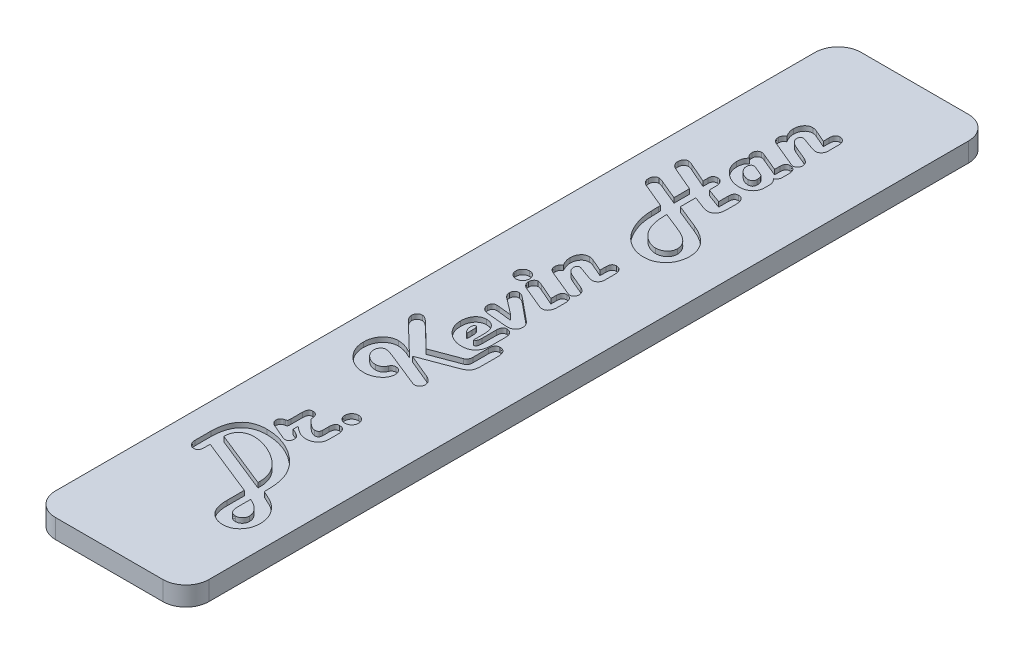
from build123d import *

# Parameters (mm, degrees)
BOSS_EXTRUDE1_DEPTH      = 66.675
BOSS_EXTRUDE1_DEPTH_BACK = 66.675
SKETCH3_W                = 25.4
SKETCH3_H                = 3.175
SKETCH5_OUTSIDE_W        = 54.556
SKETCH5_OUTSIDE_H        = 162.506
CUT_EXTRUDE2_DEPTH       = 68.947967225
CUT_EXTRUDE1_DEPTH       = 0.79375


with BuildPart() as part:
    # Sketch3 → Boss-Extrude1 (new, two sides: drawn at the far end of the back side and taken through both)
    with BuildSketch(Plane.XY.offset(-BOSS_EXTRUDE1_DEPTH_BACK)):
        Rectangle(SKETCH3_W, SKETCH3_H)
    extrude(amount=BOSS_EXTRUDE1_DEPTH + BOSS_EXTRUDE1_DEPTH_BACK)

    # Sketch5 outside → Cut-Extrude2 (cut, through all)
    with BuildSketch(Plane(origin=(0, 1.5875, 0), x_dir=(1, 0, 0), z_dir=(0, 1, 0))):
        Rectangle(SKETCH5_OUTSIDE_W, SKETCH5_OUTSIDE_H)
        with BuildLine():
            Line((12.7, -62.865), (12.7, 62.865))
            ThreePointArc((12.7, 62.865), (11.584076836, 65.559076836), (8.89, 66.675))
            Line((8.89, 66.675), (-8.89, 66.675))
            ThreePointArc((-8.89, 66.675), (-11.584076836, 65.559076836), (-12.7, 62.865))
            Line((-12.7, 62.865), (-12.7, -62.865))
            ThreePointArc((-12.7, -62.865), (-11.584076836, -65.559076836), (-8.89, -66.675))
            Line((-8.89, -66.675), (8.89, -66.675))
            ThreePointArc((8.89, -66.675), (11.584076836, -65.559076836), (12.7, -62.865))
        make_face(mode=Mode.SUBTRACT)
    extrude(amount=-CUT_EXTRUDE2_DEPTH, mode=Mode.SUBTRACT)

    # Sketch4 → Cut-Extrude1 (cut)
    # profile 1 of 12: a face of its own
    with BuildSketch(Plane(origin=(0, 1.5875, 0), x_dir=(1, 0, 0), z_dir=(0, 1, 0))):
        with BuildLine():
            Line((-6.58846479, -43.37447098), (-6.58846479, -44.16845724))
            Line((-6.58846479, -44.16845724), (-6.58846479, -44.384782838))
            add(Edge.make_bspline(
                [(-6.58846479, -44.384782838), (-6.590642683, -44.459401589), (-6.594722407, -44.599180715), (-6.627055141, -44.794889676), (-6.683239814, -44.962326165), (-6.764368122, -45.100724183), (-6.86928267, -45.21053193), (-7.000722107, -45.285170443), (-7.153530359, -45.331629982), (-7.26323165, -45.335839003), (-7.320643737, -45.338041792)],
                knots=[0, 0, 0, 0, 1.305737749, 2.445965353, 3.459324035, 4.379959175, 5.233349143, 6.085046436, 6.997810513, 8, 8, 8, 8], degree=3))
            add(Edge.make_bspline(
                [(-7.320643737, -45.338041792), (-7.395678763, -45.333581495), (-7.543761821, -45.324779013), (-7.756194415, -45.250891013), (-7.944722318, -45.124571129), (-8.110540018, -44.958253396), (-8.244720243, -44.756483902), (-8.343478445, -44.528842358), (-8.404536957, -44.279395202), (-8.410899331, -44.105417079), (-8.414157748, -44.01631616)],
                knots=[0, 0, 0, 0, 0.941902933, 1.858863449, 2.78744378, 3.773831386, 4.79357467, 5.815409039, 6.881186575, 8, 8, 8, 8], degree=3))
            Line((-8.414157748, -44.01631616), (-8.414157748, -43.799990563))
            Line((-8.414157748, -43.799990563), (-8.414157748, -41.448935438))
            add(Edge.make_bspline(
                [(-8.414157748, -41.448935438), (-8.411338803, -41.255464832), (-8.405863121, -40.879656325), (-8.352858703, -40.333775097), (-8.265968104, -39.822506375), (-8.14282038, -39.346005689), (-7.985411981, -38.903646933), (-7.79662264, -38.493759304), (-7.566646543, -38.121624657), (-7.304070026, -37.783958091), (-7.008859388, -37.483041126), (-6.680721609, -37.222031094), (-6.321435237, -37.00178132), (-5.930542639, -36.823575729), (-5.510018335, -36.682551692), (-5.058898291, -36.584241541), (-4.577441259, -36.523291569), (-4.24631644, -36.517065897), (-4.075759769, -36.513859161)],
                knots=[0, 0, 0, 0, 1.240121913, 2.408884614, 3.512215636, 4.562072732, 5.559962685, 6.519078054, 7.449661058, 8.358196616, 9.256317547, 10.145746268, 11.039719344, 11.951275398, 12.894325228, 13.877939151, 14.906963136, 16, 16, 16, 16], degree=3))
            add(Edge.make_bspline(
                [(-4.075759769, -36.513859161), (-3.811543018, -36.519920378), (-3.28665348, -36.531961514), (-2.50806029, -36.639041066), (-1.745756617, -36.806457699), (-1.000691918, -37.043884604), (-0.272253043, -37.346450176), (0.437070688, -37.720622904), (1.133492833, -38.157145176), (1.571301501, -38.497301187), (1.793557827, -38.669983527)],
                knots=[0, 0, 0, 0, 0.99369571, 1.974062893, 2.951324249, 3.9272385, 4.912259598, 5.915104549, 6.941589699, 8, 8, 8, 8], degree=3))
            add(Edge.make_bspline(
                [(1.793557827, -38.669983527), (1.916045117, -38.771570297), (2.158066946, -38.972294929), (2.494929158, -39.294397177), (2.806410196, -39.624779777), (3.094628993, -39.963936185), (3.354503101, -40.315004062), (3.59145039, -40.674654808), (3.801289278, -41.045009153), (3.987597448, -41.426651863), (4.150094171, -41.822738471), (4.287621244, -42.237076314), (4.406429572, -42.669388681), (4.504559656, -43.121563388), (4.575945965, -43.592663931), (4.632487149, -44.081716654), (4.662001894, -44.590443603), (4.667286453, -44.936262525), (4.669975118, -45.112207376)],
                knots=[0, 0, 0, 0, 1.041972891, 2.058827374, 3.050103684, 4.014970579, 4.971989252, 5.909071109, 6.834104011, 7.757898592, 8.688895906, 9.635856426, 10.615406742, 11.624176682, 12.664286734, 13.734882699, 14.847559518, 16, 16, 16, 16], degree=3))
            Line((4.669975118, -45.112207376), (4.669975118, -45.677982017))
            Line((4.669975118, -45.677982017), (4.898186737, -45.775447396))
            add(Edge.make_bspline(
                [(4.898186737, -45.775447396), (5.000384129, -45.821452118), (5.197004201, -45.909961734), (5.481245062, -46.037024203), (5.73912914, -46.161723252), (5.975211616, -46.275110816), (6.187011342, -46.381768262), (6.37409167, -46.482199773), (6.539806342, -46.571267398), (6.727151964, -46.686438715), (6.944767211, -46.835432962), (7.198129433, -47.030244402), (7.44537137, -47.251801045), (7.602053464, -47.413928836), (7.681893058, -47.496543362)],
                knots=[0, 0, 0, 0, 1.222800361, 2.352575644, 3.396669397, 4.347862466, 5.210067408, 5.983579217, 6.664594993, 7.262130753, 8.381971782, 9.540587582, 10.746771362, 12, 12, 12, 12], degree=3))
            add(Edge.make_bspline(
                [(7.681893058, -47.496543362), (7.781342309, -47.609012601), (7.97712091, -47.83042272), (8.232866488, -48.186451667), (8.446377269, -48.556069995), (8.625352234, -48.936013004), (8.760372066, -49.330218339), (8.858034916, -49.736839458), (8.919740085, -50.155536695), (8.926515053, -50.43931152), (8.929925353, -50.582154637)],
                knots=[0, 0, 0, 0, 1.055914228, 2.078702545, 3.078046045, 4.055880218, 5.029205391, 6.004237832, 6.995397536, 8, 8, 8, 8], degree=3))
            add(Edge.make_bspline(
                [(8.929925353, -50.582154637), (8.926811107, -50.698721441), (8.920693058, -50.927721162), (8.883777703, -51.262981923), (8.816200107, -51.581784538), (8.723498626, -51.885061225), (8.604741283, -52.173546153), (8.459063448, -52.445959671), (8.287014187, -52.701613267), (8.089971168, -52.938624475), (7.872775685, -53.153773885), (7.639886764, -53.342614278), (7.391470586, -53.501057757), (7.130166291, -53.633215613), (6.851585263, -53.731941154), (6.560787319, -53.80704094), (6.25447165, -53.849924889), (6.04571327, -53.855237033), (5.939402253, -53.857942262)],
                knots=[0, 0, 0, 0, 1.126201464, 2.212463691, 3.25287726, 4.269850786, 5.272053028, 6.261782411, 7.249022054, 8.243830034, 9.23438794, 10.19795826, 11.134388982, 12.075812372, 13.02018767, 13.98375799, 14.973220915, 16, 16, 16, 16], degree=3))
            add(Edge.make_bspline(
                [(5.939402253, -53.857942262), (5.807431965, -53.854008507), (5.545977074, -53.846215088), (5.162632616, -53.764306139), (4.789742239, -53.644786956), (4.435932469, -53.470386974), (4.106044441, -53.255845109), (3.812133296, -53.002259022), (3.554125988, -52.713886185), (3.417371224, -52.496386466), (3.348249487, -52.386452756)],
                knots=[0, 0, 0, 0, 1.014242392, 2.009381349, 3.004557683, 4.021967388, 5.035219112, 6.025505851, 7.00200576, 8, 8, 8, 8], degree=3))
            add(Edge.make_bspline(
                [(3.348249487, -52.386452756), (3.307204143, -52.31027945), (3.22348287, -52.154906739), (3.122422879, -51.903558439), (3.037507493, -51.633809128), (2.965299145, -51.345069853), (2.912554461, -51.036554254), (2.871352784, -50.709072373), (2.847683101, -50.362220456), (2.845434985, -50.124181973), (2.84428216, -50.00211677)],
                knots=[0, 0, 0, 0, 0.84245226, 1.718372183, 2.633912599, 3.596293803, 4.615457363, 5.681185209, 6.810920853, 8, 8, 8, 8], degree=3))
            Line((2.84428216, -50.00211677), (2.84428216, -47.154225932))
            Line((2.84428216, -47.154225932), (-6.58846479, -43.37447098))
        make_face()
        with BuildLine():
            Line((2.84428216, -44.898258983), (2.84428216, -44.577336392))
            add(Edge.make_bspline(
                [(2.84428216, -44.577336392), (2.842346756, -44.474264174), (2.838514431, -44.270169141), (2.811166467, -43.967043634), (2.76966967, -43.669823216), (2.707003305, -43.37949223), (2.628561752, -43.096091289), (2.533527506, -42.818558621), (2.418173976, -42.547841386), (2.289206846, -42.281188014), (2.13698167, -42.024024736), (1.97147328, -41.77167525), (1.786743144, -41.526742652), (1.588702052, -41.285435186), (1.366608073, -41.055773573), (1.133551256, -40.826198464), (0.877351511, -40.60810742), (0.698200584, -40.468846235), (0.607332845, -40.398211106)],
                knots=[0, 0, 0, 0, 1.003752549, 1.98754731, 2.96218803, 3.924869515, 4.877913061, 5.824875223, 6.779479857, 7.742439712, 8.707376773, 9.687714611, 10.680189018, 11.694008127, 12.725763052, 13.790025714, 14.879071578, 16, 16, 16, 16], degree=3))
            add(Edge.make_bspline(
                [(0.607332845, -40.398211106), (0.42702172, -40.266952688), (0.067322249, -40.005107595), (-0.505938783, -39.664707291), (-1.099407897, -39.363005655), (-1.709508649, -39.109764799), (-2.317523255, -38.903523952), (-2.91025435, -38.754452003), (-3.480056991, -38.661078146), (-3.853562266, -38.649479392), (-4.035347294, -38.643834279)],
                knots=[0, 0, 0, 0, 1.061151743, 2.116872814, 3.169496409, 4.227969904, 5.258553914, 6.222792805, 7.135033211, 8, 8, 8, 8], degree=3))
            add(Edge.make_bspline(
                [(-4.035347294, -38.643834279), (-4.131319274, -38.645381711), (-4.319035124, -38.648408404), (-4.593358622, -38.680217107), (-4.852343188, -38.730987582), (-5.094559456, -38.806166368), (-5.322087425, -38.898477989), (-5.534618474, -39.012549667), (-5.729925401, -39.149137038), (-5.909559125, -39.303481447), (-6.067808851, -39.478153072), (-6.210457968, -39.665638499), (-6.325854787, -39.871496192), (-6.421799379, -40.090517387), (-6.499313504, -40.324057579), (-6.548611923, -40.574142086), (-6.584909909, -40.837731252), (-6.587258602, -41.018524623), (-6.58846479, -41.111372417)],
                knots=[0, 0, 0, 0, 1.145531499, 2.240595844, 3.292755274, 4.292422607, 5.264114043, 6.220902991, 7.165828125, 8.104908158, 9.042461542, 9.975419986, 10.911970153, 11.852526766, 12.827988561, 13.843075609, 14.892295267, 16, 16, 16, 16], degree=3))
            Line((-6.58846479, -41.111372417), (2.84428216, -44.898258983))
        make_face(mode=Mode.SUBTRACT)
        with BuildLine():
            Line((4.669975118, -47.931571762), (4.669975118, -50.059169675))
            add(Edge.make_bspline(
                [(4.669975118, -50.059169675), (4.67351424, -50.178249295), (4.680136569, -50.401068541), (4.731090743, -50.712886768), (4.818456327, -50.979193799), (4.94992539, -51.196475404), (5.114814511, -51.370665909), (5.32174968, -51.491200684), (5.56375052, -51.564255522), (5.736789361, -51.571841645), (5.827673647, -51.575826065)],
                knots=[0, 0, 0, 0, 1.31364871, 2.458071474, 3.475829816, 4.38621616, 5.23967168, 6.094559773, 6.99921559, 8, 8, 8, 8], degree=3))
            add(Edge.make_bspline(
                [(5.827673647, -51.575826065), (5.904270093, -51.572039412), (6.053989844, -51.564637807), (6.267291195, -51.496737147), (6.463225966, -51.390924969), (6.630850625, -51.239590156), (6.775039497, -51.063215915), (6.878366539, -50.860695206), (6.939563151, -50.638753534), (6.947843521, -50.485076953), (6.952091315, -50.406241514)],
                knots=[0, 0, 0, 0, 1.015443884, 1.984844108, 2.946375274, 3.953924431, 4.965428653, 5.959234333, 6.953095811, 8, 8, 8, 8], degree=3))
            add(Edge.make_bspline(
                [(6.952091315, -50.406241514), (6.950249979, -50.345914459), (6.946570965, -50.225380247), (6.917110524, -50.045966308), (6.868058012, -49.869157264), (6.80559351, -49.692593356), (6.718105461, -49.520681615), (6.611913222, -49.352014785), (6.492068023, -49.181750199), (6.296884965, -48.961911902), (6.017141298, -48.69478002), (5.623288822, -48.407594436), (5.17147046, -48.146581378), (4.84121642, -48.004989247), (4.669975118, -47.931571762)],
                knots=[0, 0, 0, 0, 0.609246736, 1.21728261, 1.830931323, 2.461525313, 3.105941494, 3.774613737, 4.474427454, 5.206422339, 6.740961797, 8.372497183, 10.119089455, 12, 12, 12, 12], degree=3))
        make_face(mode=Mode.SUBTRACT)
    # profile 2 of 12: a face of its own
    with BuildSketch(Plane(origin=(0, 1.5875, 0), x_dir=(1, 0, 0), z_dir=(0, 1, 0))):
        with BuildLine():
            Line((-1.872091315, -34.362489204), (-1.220737317, -34.645376524))
            add(Edge.make_bspline(
                [(-1.220737317, -34.645376524), (-1.151859692, -34.677272094), (-1.020653089, -34.738030712), (-0.844270768, -34.84656572), (-0.691358374, -34.957626223), (-0.566805489, -35.078958129), (-0.469175045, -35.208432541), (-0.401800235, -35.346585092), (-0.359141111, -35.49153005), (-0.353514496, -35.591215965), (-0.350680517, -35.641425156)],
                knots=[0, 0, 0, 0, 1.297501196, 2.471640463, 3.537215363, 4.524637192, 5.43567625, 6.296618738, 7.14205136, 8, 8, 8, 8], degree=3))
            add(Edge.make_bspline(
                [(-0.350680517, -35.641425156), (-0.352357085, -35.701141409), (-0.355618702, -35.817314168), (-0.398337226, -35.98245974), (-0.462146919, -36.134454564), (-0.555187896, -36.264895895), (-0.663339937, -36.376283857), (-0.789103622, -36.456963996), (-0.929158588, -36.503654629), (-1.026260792, -36.510415136), (-1.075727851, -36.513859161)],
                knots=[0, 0, 0, 0, 1.131994738, 2.202197021, 3.220602635, 4.248319073, 5.22801886, 6.155513921, 7.060358075, 8, 8, 8, 8], degree=3))
            add(Edge.make_bspline(
                [(-1.075727851, -36.513859161), (-1.110730729, -36.510758409), (-1.192127367, -36.503547838), (-1.327463713, -36.467337786), (-1.492373169, -36.40834067), (-1.611584341, -36.35986006), (-1.677160557, -36.333191629)],
                knots=[0, 0, 0, 0, 0.667539348, 1.552314029, 2.65356594, 4, 4, 4, 4], degree=3))
            Line((-1.677160557, -36.333191629), (-3.830907718, -35.408459128))
            add(Edge.make_bspline(
                [(-3.830907718, -35.408459128), (-3.892669145, -35.380569677), (-4.010603358, -35.327314423), (-4.169239448, -35.227753699), (-4.305372125, -35.122304362), (-4.417067446, -35.006510166), (-4.504419832, -34.882631429), (-4.563944101, -34.748272046), (-4.604971851, -34.6065883), (-4.608723659, -34.507795197), (-4.610630752, -34.457577379)],
                knots=[0, 0, 0, 0, 1.242093141, 2.371792344, 3.427691145, 4.394328043, 5.313892613, 6.192305435, 7.081125362, 8, 8, 8, 8], degree=3))
            add(Edge.make_bspline(
                [(-4.610630752, -34.457577379), (-4.608581278, -34.409149466), (-4.604690623, -34.317215481), (-4.581492232, -34.185360538), (-4.539107743, -34.068467791), (-4.478382581, -33.966261014), (-4.400853895, -33.878100508), (-4.304209135, -33.807781637), (-4.192531652, -33.748329743), (-4.109623763, -33.723910172), (-4.066250951, -33.711135206)],
                knots=[0, 0, 0, 0, 1.15314347, 2.189090296, 3.173792814, 4.095790583, 5.004376053, 5.947550008, 6.926271946, 8, 8, 8, 8], degree=3))
            Line((-4.066250951, -33.711135206), (-3.826153309, -33.644573483))
            add(Edge.make_bspline(
                [(-3.826153309, -33.644573483), (-3.797267881, -33.636871541), (-3.744360577, -33.622764461), (-3.675749324, -33.58891798), (-3.624018202, -33.549273641), (-3.587295124, -33.49578576), (-3.567835304, -33.420601348), (-3.555297438, -33.316160619), (-3.545891312, -33.177195015), (-3.545731492, -33.072472252), (-3.545643193, -33.014614325)],
                knots=[0, 0, 0, 0, 0.926850573, 1.697643703, 2.362895762, 2.92973869, 3.677374781, 4.746381598, 6.202419277, 8, 8, 8, 8], degree=3))
            Line((-3.545643193, -33.014614325), (-3.545643193, -31.13662287))
            add(Edge.make_bspline(
                [(-3.545643193, -31.13662287), (-3.543553084, -31.057242339), (-3.53964409, -30.908782192), (-3.506346467, -30.700968008), (-3.453594835, -30.523726475), (-3.378074757, -30.375760212), (-3.274895726, -30.26245496), (-3.149627924, -30.181664187), (-3.002333573, -30.132695771), (-2.897054984, -30.126942805), (-2.841990699, -30.123933808)],
                knots=[0, 0, 0, 0, 1.361355543, 2.546053047, 3.599677592, 4.524244374, 5.371169927, 6.197098625, 7.057021238, 8, 8, 8, 8], degree=3))
            add(Edge.make_bspline(
                [(-2.841990699, -30.123933808), (-2.765377251, -30.126631573), (-2.61959098, -30.1317651), (-2.417405619, -30.196357002), (-2.243190157, -30.29741217), (-2.106049418, -30.446647352), (-1.996448832, -30.632466534), (-1.923328117, -30.859550765), (-1.878051966, -31.125301371), (-1.87416737, -31.315490007), (-1.872091315, -31.417132986)],
                knots=[0, 0, 0, 0, 0.994284648, 1.892005291, 2.734571892, 3.588753721, 4.500369607, 5.525254763, 6.677415825, 8, 8, 8, 8], degree=3))
            Line((-1.872091315, -31.417132986), (-1.793643571, -31.500335139))
            add(Edge.make_bspline(
                [(-1.793643571, -31.500335139), (-1.697764567, -31.595454283), (-1.514237846, -31.777526518), (-1.240252733, -32.024103471), (-0.981932021, -32.23222715), (-0.743613405, -32.405651329), (-0.518496546, -32.537722783), (-0.31230491, -32.634127517), (-0.121406518, -32.69760794), (0.0023284, -32.706259498), (0.06057584, -32.710332165)],
                knots=[0, 0, 0, 0, 1.435762249, 2.748263184, 3.91660617, 4.961556361, 5.879059361, 6.685751502, 7.381325737, 8, 8, 8, 8], degree=3))
            add(Edge.make_bspline(
                [(0.06057584, -32.710332165), (0.111592572, -32.709323916), (0.208533185, -32.70740807), (0.342462699, -32.671190018), (0.461012026, -32.624750138), (0.553384709, -32.546558143), (0.627913741, -32.450829168), (0.678585802, -32.333054616), (0.710693184, -32.195382178), (0.713047618, -32.09722226), (0.714307042, -32.044714941)],
                knots=[0, 0, 0, 0, 1.140484469, 2.167117703, 3.098941929, 3.971150526, 4.846255631, 5.80154673, 6.824011975, 8, 8, 8, 8], degree=3))
            Line((0.714307042, -32.044714941), (0.714307042, -31.032025878))
            add(Edge.make_bspline(
                [(0.714307042, -31.032025878), (0.716548445, -30.948732519), (0.720731956, -30.793268011), (0.752043767, -30.575002127), (0.81132723, -30.390431656), (0.890882578, -30.236605399), (0.997022889, -30.116979316), (1.126943844, -30.031209503), (1.281996492, -29.979928434), (1.392991758, -29.974592792), (1.451240397, -29.971792728)],
                knots=[0, 0, 0, 0, 1.364190584, 2.546219988, 3.596843527, 4.525897283, 5.362221888, 6.186477391, 7.048290713, 8, 8, 8, 8], degree=3))
            add(Edge.make_bspline(
                [(1.451240397, -29.971792728), (1.533398612, -29.976096123), (1.691383423, -29.984371267), (1.913318961, -30.055103795), (2.106063134, -30.17253355), (2.263479589, -30.339005487), (2.39176353, -30.543623353), (2.476690827, -30.789105517), (2.533319123, -31.067469916), (2.537697399, -31.26546194), (2.54, -31.369588899)],
                knots=[0, 0, 0, 0, 0.982615473, 1.889504555, 2.759142238, 3.658944971, 4.610088785, 5.631441668, 6.75433984, 8, 8, 8, 8], degree=3))
            Line((2.54, -31.369588899), (2.54, -32.943298194))
            add(Edge.make_bspline(
                [(2.54, -32.943298194), (2.538114595, -33.006001344), (2.534422413, -33.128792681), (2.507108253, -33.30865447), (2.465552522, -33.480590873), (2.402861286, -33.642956189), (2.323345428, -33.79635583), (2.22853336, -33.942636227), (2.113196526, -34.077930954), (1.982702847, -34.20389307), (1.838023598, -34.316960362), (1.683573729, -34.417783965), (1.517407361, -34.501227373), (1.341777516, -34.570477989), (1.154368167, -34.622545885), (0.957155532, -34.659881109), (0.749812151, -34.684940732), (0.608200611, -34.687077185), (0.536016714, -34.688166203)],
                knots=[0, 0, 0, 0, 1.009407673, 1.976719137, 2.923785669, 3.852797958, 4.771676065, 5.702527031, 6.65345443, 7.628144937, 8.618662201, 9.606215811, 10.593522047, 11.607757909, 12.641947342, 13.720607507, 14.838121302, 16, 16, 16, 16], degree=3))
            add(Edge.make_bspline(
                [(0.536016714, -34.688166203), (0.442312196, -34.684794715), (0.25451501, -34.678037775), (-0.024475394, -34.628418744), (-0.299958548, -34.550340824), (-0.5754868, -34.43453964), (-0.862356485, -34.276504234), (-1.173445426, -34.072423304), (-1.515172685, -33.819489772), (-1.748514194, -33.628982616), (-1.872091315, -33.528090469)],
                knots=[0, 0, 0, 0, 0.822710096, 1.64882809, 2.481516469, 3.333299355, 4.267584386, 5.354441073, 6.598918144, 8, 8, 8, 8], degree=3))
            Line((-1.872091315, -33.528090469), (-1.872091315, -34.362489204))
        make_face()
    # profile 3 of 12: a face of its own
    with BuildSketch(Plane(origin=(0, 1.5875, 0), x_dir=(1, 0, 0), z_dir=(0, 1, 0))):
        with BuildLine():
            add(Edge.make_bspline(
                [(0.410024882, -28.065274821), (0.414030163, -27.989531494), (0.421846668, -27.841714623), (0.486933473, -27.628677009), (0.593319733, -27.432731496), (0.740943421, -27.25988967), (0.913785247, -27.112265982), (1.10973076, -27.005879722), (1.322768374, -26.940792917), (1.470585245, -26.932976412), (1.546328572, -26.928971131)],
                knots=[0, 0, 0, 0, 1.018015329, 1.986707578, 2.970091954, 4, 5.029908046, 6.013292422, 6.981984671, 8, 8, 8, 8], degree=3))
            add(Edge.make_bspline(
                [(1.546328572, -26.928971131), (1.622838752, -26.9330659), (1.772922407, -26.941098268), (1.98927649, -27.005387689), (2.187998236, -27.1115735), (2.361181475, -27.259954284), (2.508856681, -27.43271505), (2.615229807, -27.62868123), (2.68032, -27.841713511), (2.688136038, -27.989531118), (2.69214108, -28.065274821)],
                knots=[0, 0, 0, 0, 1.023458974, 2.007634331, 2.995409192, 4.02013336, 5.044857529, 6.023292197, 6.987108688, 8, 8, 8, 8], degree=3))
            add(Edge.make_bspline(
                [(2.69214108, -28.065274821), (2.688046554, -28.141785384), (2.680014663, -28.291869789), (2.615721767, -28.508218403), (2.50954926, -28.706961089), (2.3611169, -28.880063149), (2.18801484, -29.028495509), (1.989272154, -29.134668016), (1.77292354, -29.198960912), (1.622839135, -29.206992803), (1.546328572, -29.211087329)],
                knots=[0, 0, 0, 0, 1.018333356, 1.997579833, 2.980407786, 4, 5.019592214, 6.002420167, 6.981666644, 8, 8, 8, 8], degree=3))
            add(Edge.make_bspline(
                [(1.546328572, -29.211087329), (1.470584869, -29.207082287), (1.322767263, -29.199266249), (1.109734981, -29.134176056), (0.913768801, -29.02780293), (0.741008036, -28.880127724), (0.592627252, -28.706944485), (0.48644144, -28.508222739), (0.422152019, -28.291868656), (0.414119651, -28.141785001), (0.410024882, -28.065274821)],
                knots=[0, 0, 0, 0, 1.012891312, 1.976707803, 2.955142471, 3.97986664, 5.004590808, 5.992365669, 6.976541026, 8, 8, 8, 8], degree=3))
        make_face()
    # profile 4 of 12: a face of its own
    with BuildSketch(Plane(origin=(0, 1.5875, 0), x_dir=(1, 0, 0), z_dir=(0, 1, 0))):
        with BuildLine():
            Line((-2.383190255, -11.821837344), (2.112103213, -10.129267831))
            add(Edge.make_bspline(
                [(2.112103213, -10.129267831), (2.158055263, -10.109341128), (2.248060323, -10.070311223), (2.36704323, -9.988126643), (2.470633307, -9.892054569), (2.55050097, -9.775542612), (2.615842394, -9.646380912), (2.661341944, -9.500311679), (2.686442869, -9.338536038), (2.690195971, -9.225225284), (2.69214108, -9.16650006)],
                knots=[0, 0, 0, 0, 0.995876498, 1.950596866, 2.866397812, 3.795174153, 4.74845718, 5.742203459, 6.829858564, 8, 8, 8, 8], degree=3))
            Line((2.69214108, -9.16650006), (2.69214108, -6.568215681))
            add(Edge.make_bspline(
                [(2.69214108, -6.568215681), (2.693884465, -6.482474248), (2.697149524, -6.321895358), (2.734731798, -6.097515862), (2.797493138, -5.90709516), (2.88635734, -5.750102513), (3.00091579, -5.625888869), (3.143994837, -5.53857587), (3.312030078, -5.484711351), (3.432609751, -5.479698872), (3.495636158, -5.477078874)],
                knots=[0, 0, 0, 0, 1.333706872, 2.497802535, 3.527686031, 4.439627138, 5.286144861, 6.128246801, 7.021643731, 8, 8, 8, 8], degree=3))
            add(Edge.make_bspline(
                [(3.495636158, -5.477078874), (3.582570388, -5.481068756), (3.750383225, -5.488770595), (3.987432238, -5.564614748), (4.192803225, -5.692341657), (4.365554877, -5.86716551), (4.504896432, -6.083791582), (4.600932471, -6.341566772), (4.661364711, -6.635155), (4.667006949, -6.8436444), (4.669975118, -6.953322789)],
                knots=[0, 0, 0, 0, 0.977959628, 1.887796998, 2.770468899, 3.680218527, 4.63684519, 5.652287424, 6.764957198, 8, 8, 8, 8], degree=3))
            Line((4.669975118, -6.953322789), (4.669975118, -9.615791687))
            add(Edge.make_bspline(
                [(4.669975118, -9.615791687), (4.66919593, -9.700604694), (4.667694615, -9.864019805), (4.652576113, -10.099486044), (4.632103496, -10.316158059), (4.602857702, -10.513609119), (4.559082734, -10.690302751), (4.509456853, -10.847649851), (4.453957727, -10.987895823), (4.382667103, -11.109161611), (4.298985523, -11.220889728), (4.195365075, -11.324709486), (4.073479321, -11.427028095), (3.932011234, -11.527209592), (3.770792933, -11.624298995), (3.588360555, -11.715779479), (3.389262983, -11.809412054), (3.247928361, -11.866142777), (3.174713567, -11.89553068)],
                knots=[0, 0, 0, 0, 1.357162173, 2.614938602, 3.774589311, 4.839989926, 5.805787506, 6.684116007, 7.480129129, 8.213139895, 8.928383446, 9.708581851, 10.554546318, 11.472973782, 12.479939445, 13.563228336, 14.737692638, 16, 16, 16, 16], degree=3))
            Line((3.174713567, -11.89553068), (-2.487787248, -14.020751389))
            Line((-2.487787248, -14.020751389), (1.513047711, -15.682417245))
            add(Edge.make_bspline(
                [(1.513047711, -15.682417245), (1.605888148, -15.722507463), (1.783878641, -15.79936705), (2.02473615, -15.939852532), (2.229293283, -16.09268106), (2.399503545, -16.256787448), (2.529375861, -16.437791415), (2.624925543, -16.630718531), (2.680929217, -16.838604204), (2.688371766, -16.981628729), (2.69214108, -17.054064168)],
                knots=[0, 0, 0, 0, 1.258066789, 2.411922376, 3.461510865, 4.431099922, 5.342755986, 6.220699694, 7.098865049, 8, 8, 8, 8], degree=3))
            add(Edge.make_bspline(
                [(2.69214108, -17.054064168), (2.689770289, -17.11380667), (2.685144394, -17.23037642), (2.637769835, -17.398455243), (2.560133792, -17.552649485), (2.4565872, -17.69035674), (2.335617157, -17.808087656), (2.19580456, -17.890249949), (2.046137195, -17.943476303), (1.941384167, -17.949576341), (1.888646002, -17.952647421)],
                knots=[0, 0, 0, 0, 1.071766984, 2.091234951, 3.110503861, 4.158918835, 5.17669358, 6.122117864, 7.054575716, 8, 8, 8, 8], degree=3))
            add(Edge.make_bspline(
                [(1.888646002, -17.952647421), (1.843406074, -17.950290628), (1.749225597, -17.945384258), (1.60237794, -17.921010706), (1.446409633, -17.877027771), (1.340084985, -17.839186979), (1.284836091, -17.819523976)],
                knots=[0, 0, 0, 0, 0.874488799, 1.82051067, 2.867483918, 4, 4, 4, 4], degree=3))
            Line((1.284836091, -17.819523976), (1.054247267, -17.724435801))
            Line((1.054247267, -17.724435801), (-4.030592885, -15.677662836))
            add(Edge.make_bspline(
                [(-4.030592885, -15.677662836), (-4.12304556, -15.640524083), (-4.29994097, -15.569464213), (-4.557885948, -15.478330651), (-4.791355793, -15.395569302), (-5.00400291, -15.333089608), (-5.192300911, -15.27757496), (-5.360226858, -15.243174223), (-5.505379139, -15.219338783), (-5.594722796, -15.215739071), (-5.635205837, -15.214107984)],
                knots=[0, 0, 0, 0, 1.425480955, 2.727460724, 3.914349438, 4.968911692, 5.898756164, 6.721575704, 7.420725484, 8, 8, 8, 8], degree=3))
            add(Edge.make_bspline(
                [(-5.635205837, -15.214107984), (-5.698299683, -15.217482456), (-5.823458273, -15.224176362), (-6.003331491, -15.287024945), (-6.168719325, -15.389445268), (-6.311617616, -15.530160156), (-6.437633924, -15.690929222), (-6.521092171, -15.875866986), (-6.581067084, -16.070924548), (-6.585969546, -16.207304167), (-6.58846479, -16.276718338)],
                knots=[0, 0, 0, 0, 0.955232408, 1.89488435, 2.856383616, 3.885987844, 4.925384725, 5.93705183, 6.950005589, 8, 8, 8, 8], degree=3))
            add(Edge.make_bspline(
                [(-6.58846479, -16.276718338), (-6.585765478, -16.33941367), (-6.580403286, -16.46395815), (-6.549959999, -16.64893844), (-6.49327566, -16.827405457), (-6.420391609, -17.003287511), (-6.320471643, -17.172460387), (-6.202286775, -17.338185685), (-6.062678715, -17.499433614), (-5.902692826, -17.651260083), (-5.729595323, -17.791083719), (-5.550287599, -17.916845578), (-5.364003722, -18.021969428), (-5.171824418, -18.106950177), (-4.975516543, -18.174555188), (-4.774123762, -18.222221567), (-4.567123856, -18.251530563), (-4.426889091, -18.255121342), (-4.356269885, -18.25692958)],
                knots=[0, 0, 0, 0, 0.917549988, 1.822716022, 2.73202878, 3.651334286, 4.601684754, 5.598811576, 6.626005253, 7.716394691, 8.82068124, 9.878547997, 10.916606243, 11.944061492, 12.948438288, 13.949330911, 14.967327222, 16, 16, 16, 16], degree=3))
            add(Edge.make_bspline(
                [(-4.356269885, -18.25692958), (-4.281629708, -18.253941807), (-4.136891783, -18.24814809), (-3.927539216, -18.210488662), (-3.735104788, -18.144302928), (-3.562664231, -18.047561149), (-3.407755796, -17.926697083), (-3.270434224, -17.779858025), (-3.153448695, -17.603950574), (-3.092284024, -17.473345655), (-3.060693502, -17.405890415)],
                knots=[0, 0, 0, 0, 1.082174368, 2.098490104, 3.072289808, 4.01859102, 4.951688035, 5.910874111, 6.921001678, 8, 8, 8, 8], degree=3))
            add(Edge.make_bspline(
                [(-3.060693502, -17.405890415), (-3.041941317, -17.36492253), (-3.0057908, -17.28594452), (-2.935518851, -17.179263811), (-2.854689834, -17.088727973), (-2.764123032, -17.013279063), (-2.661514967, -16.958468392), (-2.551105402, -16.918194098), (-2.430541955, -16.889950232), (-2.346119826, -16.888441705), (-2.302365307, -16.887659862)],
                knots=[0, 0, 0, 0, 1.100921818, 2.122360351, 3.110710817, 4.061275856, 4.989443286, 5.940008326, 6.93234218, 8, 8, 8, 8], degree=3))
            add(Edge.make_bspline(
                [(-2.302365307, -16.887659862), (-2.22977653, -16.891632504), (-2.088901976, -16.899342293), (-1.887745115, -16.963801885), (-1.707493639, -17.071281325), (-1.553080715, -17.219424119), (-1.42307274, -17.395605476), (-1.330143689, -17.597790221), (-1.273975489, -17.821282229), (-1.267085755, -17.976875643), (-1.263526996, -18.057244413)],
                knots=[0, 0, 0, 0, 0.996010802, 1.932978948, 2.87070649, 3.857022069, 4.854817944, 5.863551974, 6.896459075, 8, 8, 8, 8], degree=3))
            add(Edge.make_bspline(
                [(-1.263526996, -18.057244413), (-1.266729385, -18.135797652), (-1.27307419, -18.291433002), (-1.309782665, -18.521615747), (-1.38134138, -18.740636216), (-1.473725423, -18.953214797), (-1.596830415, -19.154198785), (-1.742028862, -19.35040156), (-1.920781886, -19.531155229), (-2.117500783, -19.706864559), (-2.33607201, -19.864073749), (-2.565411567, -20.005574751), (-2.807885932, -20.121072588), (-3.05718461, -20.220588335), (-3.319051839, -20.292878367), (-3.589582986, -20.348926435), (-3.872232551, -20.379028462), (-4.06381156, -20.384247719), (-4.161339126, -20.386904698)],
                knots=[0, 0, 0, 0, 0.916095415, 1.815034407, 2.706013601, 3.595075677, 4.510658747, 5.447245851, 6.433654834, 7.46765252, 8.5188748, 9.567537528, 10.604418993, 11.645570182, 12.692278575, 13.766460921, 14.862967142, 16, 16, 16, 16], degree=3))
            add(Edge.make_bspline(
                [(-4.161339126, -20.386904698), (-4.306540458, -20.382479155), (-4.593405151, -20.373735901), (-5.016663898, -20.313612466), (-5.425654794, -20.211461578), (-5.819041248, -20.064633764), (-6.199620391, -19.880286204), (-6.567401872, -19.657026061), (-6.917434282, -19.386986713), (-7.251895198, -19.084494955), (-7.556741452, -18.752371116), (-7.829103716, -18.404743482), (-8.055389381, -18.038858603), (-8.241346446, -17.659763136), (-8.389084087, -17.26702552), (-8.489497991, -16.859169053), (-8.554120073, -16.437253249), (-8.562199635, -16.1509659), (-8.566298828, -16.00571704)],
                knots=[0, 0, 0, 0, 1.012976101, 2.001270068, 2.9761113, 3.948692319, 4.925413067, 5.922911833, 6.944646097, 8.005307926, 9.065623878, 10.086340479, 11.082029652, 12.061172768, 13.028570012, 14.003411244, 14.987023899, 16, 16, 16, 16], degree=3))
            add(Edge.make_bspline(
                [(-8.566298828, -16.00571704), (-8.564000538, -15.898658888), (-8.559475921, -15.687894803), (-8.524323991, -15.378939371), (-8.460989384, -15.083479404), (-8.376908472, -14.801256282), (-8.266016919, -14.532609716), (-8.132877376, -14.277693886), (-7.975564676, -14.035500388), (-7.792227582, -13.812510285), (-7.595454639, -13.60487146), (-7.379747739, -13.427508543), (-7.155660194, -13.271921785), (-6.91646838, -13.149680513), (-6.667238889, -13.049688892), (-6.404442228, -12.981566077), (-6.129382801, -12.940435957), (-5.942009394, -12.934837299), (-5.846777026, -12.931991786)],
                knots=[0, 0, 0, 0, 1.121535366, 2.207953056, 3.251660519, 4.283813668, 5.289004511, 6.291620798, 7.293274221, 8.308494366, 9.312484571, 10.285092298, 11.229184447, 12.164917093, 13.092994976, 14.037415589, 15.002518212, 16, 16, 16, 16], degree=3))
            add(Edge.make_bspline(
                [(-5.846777026, -12.931991786), (-5.704522685, -12.937815041), (-5.408929794, -12.949915287), (-4.954870846, -13.043535995), (-4.472749176, -13.181126229), (-4.152155309, -13.315930817), (-3.985426002, -13.386037821)],
                knots=[0, 0, 0, 0, 0.884561657, 1.838046796, 2.875646115, 4, 4, 4, 4], degree=3))
            Line((-3.985426002, -13.386037821), (-3.298413939, -13.692697185))
            Line((-3.298413939, -13.692697185), (-7.700996437, -9.456518994))
            add(Edge.make_bspline(
                [(-7.700996437, -9.456518994), (-7.757258685, -9.401004137), (-7.86591485, -9.293791366), (-8.010040159, -9.126862757), (-8.136097969, -8.966016412), (-8.234568902, -8.80618805), (-8.317024597, -8.652927474), (-8.370471752, -8.500294427), (-8.406373673, -8.35196725), (-8.411610345, -8.253842649), (-8.414157748, -8.206109494)],
                knots=[0, 0, 0, 0, 1.284404036, 2.480498409, 3.58325422, 4.601917941, 5.529518507, 6.405595939, 7.224394946, 8, 8, 8, 8], degree=3))
            add(Edge.make_bspline(
                [(-8.414157748, -8.206109494), (-8.411061424, -8.143949516), (-8.405048685, -8.023241314), (-8.355143286, -7.850574277), (-8.276855043, -7.693629934), (-8.1652013, -7.557439644), (-8.03203111, -7.444182027), (-7.87784062, -7.36022966), (-7.706179153, -7.312446848), (-7.586388013, -7.306047026), (-7.525083313, -7.302771832)],
                knots=[0, 0, 0, 0, 1.052232412, 2.043325747, 3.022784086, 4.006931274, 5.008173206, 5.970055937, 6.961149273, 8, 8, 8, 8], degree=3))
            add(Edge.make_bspline(
                [(-7.525083313, -7.302771832), (-7.484504964, -7.304625071), (-7.399869089, -7.308490443), (-7.270893659, -7.341402754), (-7.136529657, -7.39592279), (-6.994744001, -7.466971874), (-6.845591124, -7.557562459), (-6.694716681, -7.674693881), (-6.532792438, -7.805904184), (-6.426992761, -7.905082447), (-6.372139192, -7.956503035)],
                knots=[0, 0, 0, 0, 0.718486061, 1.49857491, 2.343602271, 3.285758108, 4.307078984, 5.430665381, 6.667886562, 8, 8, 8, 8], degree=3))
            Line((-6.372139192, -7.956503035), (-2.383190255, -11.821837344))
        make_face()
    # profile 5 of 12: a face of its own
    with BuildSketch(Plane(origin=(0, 1.5875, 0), x_dir=(1, 0, 0), z_dir=(0, 1, 0))):
        with BuildLine():
            add(Edge.make_bspline(
                [(0.257883802, -6.601496542), (0.294036073, -6.599015169), (0.36439375, -6.594186048), (0.461816673, -6.548054845), (0.542711323, -6.473068559), (0.606256307, -6.369897041), (0.656360933, -6.240284978), (0.68974573, -6.083093602), (0.711132615, -5.897638274), (0.713197452, -5.764792384), (0.714307042, -5.693404472)],
                knots=[0, 0, 0, 0, 0.764367135, 1.48757176, 2.238468815, 3.079136104, 4.038989023, 5.178564659, 6.483834326, 8, 8, 8, 8], degree=3))
            Line((0.714307042, -5.693404472), (0.714307042, -3.311445691))
            add(Edge.make_bspline(
                [(0.714307042, -3.311445691), (0.71617462, -3.231226909), (0.719690846, -3.080193157), (0.756146779, -2.869491566), (0.809933894, -2.687424459), (0.894386273, -2.539096903), (1.00195111, -2.422175882), (1.133925252, -2.339504074), (1.29024938, -2.290547274), (1.40173746, -2.28503428), (1.460749215, -2.282116198)],
                knots=[0, 0, 0, 0, 1.330378268, 2.504800222, 3.540784378, 4.466013521, 5.313015675, 6.152526175, 7.022113639, 8, 8, 8, 8], degree=3))
            add(Edge.make_bspline(
                [(1.460749215, -2.282116198), (1.541357117, -2.285442622), (1.697132823, -2.291870976), (1.915207774, -2.363517628), (2.106220658, -2.478520371), (2.263566229, -2.641980756), (2.390500141, -2.84322381), (2.477725114, -3.08393083), (2.532965067, -3.358051013), (2.537580661, -3.553626351), (2.54, -3.656140325)],
                knots=[0, 0, 0, 0, 0.976459769, 1.88701984, 2.755728993, 3.661387505, 4.617841531, 5.626579212, 6.755933135, 8, 8, 8, 8], degree=3))
            Line((2.54, -3.656140325), (2.54, -5.926370501))
            add(Edge.make_bspline(
                [(2.54, -5.926370501), (2.538332912, -6.029458398), (2.535107276, -6.228922432), (2.505761342, -6.518882475), (2.45963344, -6.789445022), (2.392276876, -7.041470744), (2.307957655, -7.275773016), (2.200555407, -7.489617567), (2.075431707, -7.684781408), (1.933524775, -7.861893451), (1.769743526, -8.016442414), (1.591887744, -8.153649559), (1.393414096, -8.265717691), (1.17818199, -8.358615899), (0.945593441, -8.431865088), (0.695645229, -8.484169884), (0.428259869, -8.515396262), (0.243707648, -8.518367946), (0.148532401, -8.519900471)],
                knots=[0, 0, 0, 0, 1.227434829, 2.374954843, 3.467242871, 4.492791281, 5.478078509, 6.427692534, 7.336082474, 8.235159391, 9.122921699, 10.011937165, 10.903903105, 11.829580614, 12.799608803, 13.802811811, 14.866890212, 16, 16, 16, 16], degree=3))
            add(Edge.make_bspline(
                [(0.148532401, -8.519900471), (0.024746198, -8.516812076), (-0.219105173, -8.510728124), (-0.578233604, -8.459195033), (-0.923467189, -8.375853775), (-1.257848442, -8.26141785), (-1.577467842, -8.111241842), (-1.885575505, -7.929191533), (-2.177331343, -7.710858289), (-2.455767377, -7.466198906), (-2.711052853, -7.198344733), (-2.9319288, -6.911811471), (-3.122357667, -6.615227288), (-3.278282057, -6.304938922), (-3.396431, -5.9805461), (-3.482665903, -5.644676297), (-3.536959038, -5.296597278), (-3.54272587, -5.059681573), (-3.545643193, -4.939830686)],
                knots=[0, 0, 0, 0, 1.040413245, 2.049551489, 3.043375534, 4.023141954, 5.015714557, 6.007526584, 7.026927923, 8.074887039, 9.121150428, 10.132661257, 11.112246432, 12.080619832, 13.046032014, 14.009142413, 14.992865218, 16, 16, 16, 16], degree=3))
            add(Edge.make_bspline(
                [(-3.545643193, -4.939830686), (-3.543411046, -4.853425296), (-3.53904076, -4.684253544), (-3.516820631, -4.436717019), (-3.472571694, -4.203568713), (-3.416961128, -3.982448206), (-3.340025176, -3.775073494), (-3.247237741, -3.58049885), (-3.140734923, -3.397230959), (-3.013375602, -3.231573847), (-2.875167004, -3.080005611), (-2.723594281, -2.94773887), (-2.56207147, -2.835358872), (-2.38909429, -2.745038623), (-2.207161549, -2.671968228), (-2.01276503, -2.623384492), (-1.808208447, -2.590925072), (-1.667782524, -2.587924838), (-1.596335608, -2.586398357)],
                knots=[0, 0, 0, 0, 1.20765167, 2.364442186, 3.467641136, 4.520347312, 5.546697016, 6.552049339, 7.529957554, 8.502082256, 9.465848252, 10.391794486, 11.307021153, 12.208414204, 13.113065312, 14.039540961, 15.002543477, 16, 16, 16, 16], degree=3))
            add(Edge.make_bspline(
                [(-1.596335608, -2.586398357), (-1.511377896, -2.589054202), (-1.345090635, -2.594252473), (-1.104213218, -2.637227258), (-0.880985118, -2.709721807), (-0.673241372, -2.806187058), (-0.486080205, -2.9382685), (-0.314745315, -3.095244072), (-0.15927299, -3.280991353), (-0.075381353, -3.421868248), (-0.032135131, -3.494490428)],
                knots=[0, 0, 0, 0, 1.069075517, 2.092495602, 3.067309766, 4.01772645, 4.964103366, 5.938458037, 6.93727308, 8, 8, 8, 8], degree=3))
            add(Edge.make_bspline(
                [(-0.032135131, -3.494490428), (-0.007989931, -3.538326267), (0.041967167, -3.629023855), (0.096295751, -3.780597321), (0.146795345, -3.945445178), (0.189934064, -4.125396419), (0.220020615, -4.321847064), (0.240255203, -4.533012411), (0.255605733, -4.759736475), (0.257107113, -4.916030144), (0.257883802, -4.996883591)],
                knots=[0, 0, 0, 0, 0.775695059, 1.604934926, 2.492087677, 3.452766344, 4.473981776, 5.574285297, 6.74513539, 8, 8, 8, 8], degree=3))
            Line((0.257883802, -4.996883591), (0.257883802, -6.601496542))
        make_face()
        with BuildLine():
            Line((-1.263526996, -6.216389434), (-1.263526996, -5.332069407))
            add(Edge.make_bspline(
                [(-1.263526996, -5.332069407), (-1.264651885, -5.258379844), (-1.266746084, -5.121192404), (-1.276351414, -4.929502726), (-1.300397163, -4.769232568), (-1.32922665, -4.637486758), (-1.36985313, -4.536751638), (-1.41449594, -4.459486509), (-1.479590692, -4.41586057), (-1.526098294, -4.413327378), (-1.548791521, -4.412091315)],
                knots=[0, 0, 0, 0, 1.703756022, 3.171872855, 4.430737384, 5.448043455, 6.277929624, 6.938312386, 7.48195314, 8, 8, 8, 8], degree=3))
            add(Edge.make_bspline(
                [(-1.548791521, -4.412091315), (-1.574528564, -4.415409029), (-1.623954453, -4.421780428), (-1.692237928, -4.455404708), (-1.749089047, -4.505782035), (-1.795167998, -4.572973351), (-1.831217518, -4.655059223), (-1.852569919, -4.754422694), (-1.870816602, -4.868652891), (-1.871648918, -4.950828128), (-1.872091315, -4.994506387)],
                knots=[0, 0, 0, 0, 0.839283018, 1.611774451, 2.433858042, 3.284934843, 4.2429058, 5.330802008, 6.5812524, 8, 8, 8, 8], degree=3))
            add(Edge.make_bspline(
                [(-1.872091315, -4.994506387), (-1.8703591, -5.057224522), (-1.866963591, -5.180165372), (-1.837501192, -5.35957743), (-1.79081744, -5.529163068), (-1.722298304, -5.688160654), (-1.638426919, -5.838255272), (-1.530130108, -5.974932902), (-1.407858294, -6.104785597), (-1.312160486, -6.178783702), (-1.263526996, -6.216389434)],
                knots=[0, 0, 0, 0, 1.059074119, 2.076009944, 3.063613489, 4.023510937, 4.995010178, 5.959100355, 6.962817714, 8, 8, 8, 8], degree=3))
        make_face(mode=Mode.SUBTRACT)
    # profile 6 of 12: a face of its own
    with BuildSketch(Plane(origin=(0, 1.5875, 0), x_dir=(1, 0, 0), z_dir=(0, 1, 0))):
        with BuildLine():
            Line((-0.260346751, 0.03803527), (-2.692226824, 1.904140702))
            Line((-2.692226824, 1.904140702), (-2.899043604, 2.049150169))
            add(Edge.make_bspline(
                [(-2.899043604, 2.049150169), (-2.950485746, 2.087879148), (-3.049437182, 2.162376203), (-3.181505048, 2.285029719), (-3.293761524, 2.410279547), (-3.385457045, 2.540322123), (-3.457786142, 2.673223989), (-3.50787858, 2.811097632), (-3.540754762, 2.951725997), (-3.54401626, 3.047396674), (-3.545643193, 3.095120093)],
                knots=[0, 0, 0, 0, 1.207862686, 2.323382028, 3.376901507, 4.358921854, 5.303749995, 6.207171501, 7.10568307, 8, 8, 8, 8], degree=3))
            add(Edge.make_bspline(
                [(-3.545643193, 3.095120093), (-3.543171059, 3.155645603), (-3.538386567, 3.272784761), (-3.494026074, 3.438583774), (-3.424912151, 3.588884617), (-3.323159899, 3.715941027), (-3.203424996, 3.824496896), (-3.062458792, 3.901371553), (-2.906040171, 3.948930362), (-2.796383757, 3.953373959), (-2.739770911, 3.955668076)],
                knots=[0, 0, 0, 0, 1.097383048, 2.12384043, 3.096079534, 4.080812259, 5.05984735, 6.013365037, 6.974350374, 8, 8, 8, 8], degree=3))
            add(Edge.make_bspline(
                [(-2.739770911, 3.955668076), (-2.670907439, 3.948411368), (-2.51882424, 3.932385116), (-2.284058067, 3.831951529), (-2.023727132, 3.67778866), (-1.851468688, 3.542021082), (-1.757985505, 3.468341179)],
                knots=[0, 0, 0, 0, 0.742621046, 1.640059387, 2.719280429, 4, 4, 4, 4], degree=3))
            Line((-1.757985505, 3.468341179), (1.919549659, 0.45642324))
            add(Edge.make_bspline(
                [(1.919549659, 0.45642324), (1.968805523, 0.414618709), (2.065119734, 0.332874729), (2.19083912, 0.196490484), (2.298533675, 0.055836849), (2.388794061, -0.089694482), (2.454006332, -0.243631832), (2.505762322, -0.400543213), (2.534584795, -0.564718756), (2.538177316, -0.675814125), (2.54, -0.732178947)],
                knots=[0, 0, 0, 0, 1.115751992, 2.181725463, 3.197973842, 4.175077531, 5.131812556, 6.080376519, 7.026068889, 8, 8, 8, 8], degree=3))
            add(Edge.make_bspline(
                [(2.54, -0.732178947), (2.536150823, -0.82389207), (2.528746815, -1.000305034), (2.451590906, -1.249355841), (2.328640056, -1.468449185), (2.156928501, -1.654195154), (1.941995614, -1.798955534), (1.691429643, -1.905567974), (1.404176992, -1.966370964), (1.201134078, -1.973890725), (1.094659742, -1.977834038)],
                knots=[0, 0, 0, 0, 1.019019221, 1.960114267, 2.87330385, 3.797900001, 4.750394693, 5.739139237, 6.814419849, 8, 8, 8, 8], degree=3))
            add(Edge.make_bspline(
                [(1.094659742, -1.977834038), (1.052634802, -1.977654766), (0.977228173, -1.977333092), (0.902088733, -1.971089285), (0.868825326, -1.96832522)],
                knots=[0, 0, 0, 0, 1.114621895, 2, 2, 2, 2], degree=3))
            Line((0.868825326, -1.96832522), (-2.247689606, -1.668797469))
            add(Edge.make_bspline(
                [(-2.247689606, -1.668797469), (-2.347967413, -1.656307336), (-2.537425383, -1.632709341), (-2.802218911, -1.559530188), (-3.028050672, -1.452119579), (-3.218907684, -1.316114517), (-3.366136792, -1.146986925), (-3.471310247, -0.950459996), (-3.534150484, -0.727247478), (-3.541713611, -0.569360433), (-3.545643193, -0.487326896)],
                knots=[0, 0, 0, 0, 1.236771082, 2.33666996, 3.348182645, 4.285846251, 5.187033937, 6.0685639, 6.99648174, 8, 8, 8, 8], degree=3))
            add(Edge.make_bspline(
                [(-3.545643193, -0.487326896), (-3.543625376, -0.425338572), (-3.539809835, -0.308123313), (-3.504749807, -0.144304074), (-3.444895165, -0.004637443), (-3.360521888, 0.110711094), (-3.248703909, 0.199441671), (-3.112924547, 0.259936015), (-2.955113711, 0.299376826), (-2.842255982, 0.302585141), (-2.78256059, 0.30428216)],
                knots=[0, 0, 0, 0, 1.179523652, 2.23039048, 3.169684158, 4.054029183, 4.923702267, 5.85544934, 6.865653292, 8, 8, 8, 8], degree=3))
            add(Edge.make_bspline(
                [(-2.78256059, 0.30428216), (-2.760374714, 0.303521022), (-2.709638356, 0.301780394), (-2.623800249, 0.298007246), (-2.518741645, 0.283908282), (-2.4418453, 0.275561702), (-2.399830686, 0.271001298)],
                knots=[0, 0, 0, 0, 0.693103353, 1.585041725, 2.680515457, 4, 4, 4, 4], degree=3))
            Line((-2.399830686, 0.271001298), (-0.260346751, 0.03803527))
        make_face()
    # profile 7 of 12: a face of its own
    with BuildSketch(Plane(origin=(0, 1.5875, 0), x_dir=(1, 0, 0), z_dir=(0, 1, 0))):
        with BuildLine():
            Line((0.714307042, 5.724308129), (0.714307042, 6.630022995))
            add(Edge.make_bspline(
                [(0.714307042, 6.630022995), (0.716247971, 6.70627164), (0.719911743, 6.850201502), (0.755484403, 7.05014654), (0.810901308, 7.2224382), (0.895160208, 7.362575248), (1.00216129, 7.474841275), (1.135337564, 7.551079071), (1.289956901, 7.601855147), (1.401657664, 7.60525527), (1.460749215, 7.607053992)],
                knots=[0, 0, 0, 0, 1.305122279, 2.463598793, 3.468268802, 4.38797846, 5.242443187, 6.094639849, 6.99203298, 8, 8, 8, 8], degree=3))
            add(Edge.make_bspline(
                [(1.460749215, 7.607053992), (1.541285965, 7.603495913), (1.696684395, 7.596630478), (1.915108631, 7.528406142), (2.104553676, 7.415499653), (2.262740155, 7.26008811), (2.391125042, 7.067279659), (2.476912163, 6.835304743), (2.533191719, 6.571706539), (2.537656229, 6.383914912), (2.54, 6.285328361)],
                knots=[0, 0, 0, 0, 0.999294106, 1.928172372, 2.812101714, 3.718114382, 4.663830439, 5.668552371, 6.776040317, 8, 8, 8, 8], degree=3))
            Line((2.54, 6.285328361), (2.54, 5.008769613))
            add(Edge.make_bspline(
                [(2.54, 5.008769613), (2.536312274, 4.897626521), (2.529312669, 4.686667897), (2.478191142, 4.387423732), (2.388564314, 4.124807877), (2.262828216, 3.902115213), (2.107496995, 3.720446037), (1.920120689, 3.590915563), (1.70490986, 3.513850352), (1.553300783, 3.50421854), (1.475012441, 3.499244836)],
                knots=[0, 0, 0, 0, 1.28711117, 2.443041656, 3.502572821, 4.485077292, 5.389118816, 6.247116561, 7.09484088, 8, 8, 8, 8], degree=3))
            add(Edge.make_bspline(
                [(1.475012441, 3.499244836), (1.428153296, 3.502239705), (1.327282413, 3.508686581), (1.167487558, 3.540671634), (0.991286847, 3.597583484), (0.869359383, 3.645153559), (0.804640808, 3.670403551)],
                knots=[0, 0, 0, 0, 0.809405691, 1.742359281, 2.801653991, 4, 4, 4, 4], degree=3))
            Line((0.804640808, 3.670403551), (-2.42360273, 5.015901226))
            Line((-2.42360273, 5.015901226), (-2.647059941, 5.103857788))
            add(Edge.make_bspline(
                [(-2.647059941, 5.103857788), (-2.718418733, 5.136298363), (-2.854671726, 5.19824063), (-3.039141464, 5.314042298), (-3.194176552, 5.444756675), (-3.323416544, 5.589770652), (-3.424417781, 5.749182461), (-3.493739977, 5.925166332), (-3.537976737, 6.113566336), (-3.543055036, 6.244663734), (-3.545643193, 6.311477609)],
                knots=[0, 0, 0, 0, 1.169966962, 2.233943366, 3.241792019, 4.189384164, 5.125372702, 6.044138547, 7.003193917, 8, 8, 8, 8], degree=3))
            add(Edge.make_bspline(
                [(-3.545643193, 6.311477609), (-3.542991632, 6.367244767), (-3.537840883, 6.475574391), (-3.494837297, 6.631432636), (-3.429160272, 6.776407493), (-3.332493802, 6.90311919), (-3.22123063, 7.012631418), (-3.093489832, 7.093270332), (-2.95293049, 7.140490616), (-2.855809343, 7.147208461), (-2.806332634, 7.150630752)],
                knots=[0, 0, 0, 0, 1.078211172, 2.094462323, 3.11059759, 4.141917063, 5.162215888, 6.120373975, 7.04245663, 8, 8, 8, 8], degree=3))
            add(Edge.make_bspline(
                [(-2.806332634, 7.150630752), (-2.759370816, 7.147196293), (-2.652101307, 7.139351352), (-2.477727472, 7.091548042), (-2.268941091, 7.023239878), (-2.12276403, 6.959479322), (-2.04325003, 6.924796337)],
                knots=[0, 0, 0, 0, 0.704844091, 1.609994759, 2.699940496, 4, 4, 4, 4], degree=3))
            Line((-2.04325003, 6.924796337), (0.714307042, 5.724308129))
        make_face()
    # profile 8 of 12: a face of its own
    with BuildSketch(Plane(origin=(0, 1.5875, 0), x_dir=(1, 0, 0), z_dir=(0, 1, 0))):
        with BuildLine():
            add(Edge.make_bspline(
                [(-6.132041551, 6.770278053), (-6.127897693, 6.846756826), (-6.119769031, 6.996778872), (-6.056379701, 7.212905944), (-5.948305481, 7.408941955), (-5.804462679, 7.58375728), (-5.629647355, 7.727600082), (-5.433611343, 7.835674302), (-5.217484271, 7.899063632), (-5.067462225, 7.907192293), (-4.990983452, 7.911336152)],
                knots=[0, 0, 0, 0, 1.022434278, 2.00562427, 2.98307932, 4, 5.01692068, 5.99437573, 6.977565722, 8, 8, 8, 8], degree=3))
            add(Edge.make_bspline(
                [(-4.990983452, 7.911336152), (-4.914504679, 7.907192293), (-4.764482632, 7.899063632), (-4.548355561, 7.835674302), (-4.352319549, 7.727600082), (-4.177504225, 7.58375728), (-4.033661423, 7.408941955), (-3.925587203, 7.212905944), (-3.862197873, 6.996778872), (-3.854069211, 6.846756826), (-3.849925353, 6.770278053)],
                knots=[0, 0, 0, 0, 1.022434278, 2.00562427, 2.98307932, 4, 5.01692068, 5.99437573, 6.977565722, 8, 8, 8, 8], degree=3))
            add(Edge.make_bspline(
                [(-3.849925353, 6.770278053), (-3.854069211, 6.69379928), (-3.862197873, 6.543777233), (-3.925587203, 6.327650162), (-4.033661423, 6.13161415), (-4.177504225, 5.956798825), (-4.352319549, 5.812956023), (-4.548355561, 5.704881804), (-4.764482632, 5.641492474), (-4.914504679, 5.633363812), (-4.990983452, 5.629219954)],
                knots=[0, 0, 0, 0, 1.022434278, 2.00562427, 2.98307932, 4, 5.01692068, 5.99437573, 6.977565722, 8, 8, 8, 8], degree=3))
            add(Edge.make_bspline(
                [(-4.990983452, 5.629219954), (-5.067462225, 5.633363812), (-5.217484271, 5.641492474), (-5.433611343, 5.704881804), (-5.629647355, 5.812956023), (-5.804462679, 5.956798825), (-5.948305481, 6.13161415), (-6.056379701, 6.327650162), (-6.119769031, 6.543777233), (-6.127897693, 6.69379928), (-6.132041551, 6.770278053)],
                knots=[0, 0, 0, 0, 1.022434278, 2.00562427, 2.98307932, 4, 5.01692068, 5.99437573, 6.977565722, 8, 8, 8, 8], degree=3))
        make_face()
    # profile 9 of 12: a face of its own
    with BuildSketch(Plane(origin=(0, 1.5875, 0), x_dir=(1, 0, 0), z_dir=(0, 1, 0))):
        with BuildLine():
            Line((0.714307042, 13.849592674), (0.714307042, 14.812360445))
            add(Edge.make_bspline(
                [(0.714307042, 14.812360445), (0.716138356, 14.891789174), (0.719566382, 15.040471352), (0.755980818, 15.247318423), (0.810458102, 15.425230501), (0.894403496, 15.570590712), (1.002085305, 15.685310578), (1.134621747, 15.764884247), (1.290163895, 15.814394841), (1.401707873, 15.819807388), (1.460749215, 15.822672303)],
                knots=[0, 0, 0, 0, 1.332558988, 2.494409445, 3.51712345, 4.441593639, 5.28878003, 6.131038744, 7.010740127, 8, 8, 8, 8], degree=3))
            add(Edge.make_bspline(
                [(1.460749215, 15.822672303), (1.541348655, 15.819337163), (1.697108009, 15.812891967), (1.915297527, 15.741363316), (2.105409679, 15.626226422), (2.263650093, 15.465503979), (2.389871778, 15.266940682), (2.477513229, 15.031271799), (2.532871988, 14.764224361), (2.537553258, 14.57414532), (2.54, 14.474797424)],
                knots=[0, 0, 0, 0, 0.988786751, 1.910841876, 2.790517751, 3.700688286, 4.660983863, 5.664234098, 6.779174028, 8, 8, 8, 8], degree=3))
            Line((2.54, 14.474797424), (2.54, 12.798868341))
            add(Edge.make_bspline(
                [(2.54, 12.798868341), (2.536089085, 12.724919371), (2.528499477, 12.581412366), (2.476786013, 12.373790147), (2.379916769, 12.188752913), (2.256178934, 12.022191034), (2.101262704, 11.886136392), (1.924666299, 11.787333382), (1.728846759, 11.723887688), (1.591203852, 11.717934847), (1.520179324, 11.714863147)],
                knots=[0, 0, 0, 0, 1.068903624, 2.074337967, 3.062738177, 4.06817252, 5.058163504, 6.016931881, 6.976725497, 8, 8, 8, 8], degree=3))
            add(Edge.make_bspline(
                [(1.520179324, 11.714863147), (1.470076135, 11.717476805), (1.357623703, 11.723342943), (1.174931617, 11.767045547), (0.957459251, 11.824744802), (0.804247244, 11.879954153), (0.721438655, 11.909793906)],
                knots=[0, 0, 0, 0, 0.728058364, 1.634066332, 2.72125148, 4, 4, 4, 4], degree=3))
            Line((0.721438655, 11.909793906), (-0.985394084, 12.523112634))
            add(Edge.make_bspline(
                [(-0.985394084, 12.523112634), (-1.065380249, 12.552110082), (-1.205893728, 12.603050546), (-1.354172852, 12.620285522), (-1.41804528, 12.627709626)],
                knots=[0, 0, 0, 0, 1.138483872, 2, 2, 2, 2], degree=3))
            add(Edge.make_bspline(
                [(-1.41804528, 12.627709626), (-1.448340053, 12.626731346), (-1.507792806, 12.624811494), (-1.595103628, 12.59727323), (-1.674177825, 12.546152143), (-1.741987643, 12.47394003), (-1.799095727, 12.388009058), (-1.843241485, 12.289655843), (-1.865852683, 12.177819849), (-1.869954945, 12.100055693), (-1.872091315, 12.059557781)],
                knots=[0, 0, 0, 0, 0.891859407, 1.750252314, 2.665438183, 3.64169252, 4.654009479, 5.701670483, 6.803079096, 8, 8, 8, 8], degree=3))
            add(Edge.make_bspline(
                [(-1.872091315, 12.059557781), (-1.868232133, 11.993433743), (-1.860520436, 11.861299885), (-1.804115134, 11.668535588), (-1.708796934, 11.486713598), (-1.574922785, 11.317386341), (-1.406868847, 11.156273901), (-1.198546757, 11.010870305), (-0.958367838, 10.868347311), (-0.779582657, 10.790516064), (-0.685866333, 10.749718172)],
                knots=[0, 0, 0, 0, 0.844704782, 1.68795045, 2.544298561, 3.454102781, 4.435689125, 5.509683468, 6.694616022, 8, 8, 8, 8], degree=3))
            Line((-0.685866333, 10.749718172), (1.529688142, 9.817854058))
            add(Edge.make_bspline(
                [(1.529688142, 9.817854058), (1.60981235, 9.782362405), (1.762812535, 9.714589759), (1.969057821, 9.589502151), (2.145613373, 9.454040267), (2.289910785, 9.303838419), (2.402126205, 9.139175809), (2.48085019, 8.961129528), (2.530438859, 8.770570698), (2.536777284, 8.639062935), (2.54, 8.572198967)],
                knots=[0, 0, 0, 0, 1.228540311, 2.345943872, 3.375718969, 4.343035516, 5.255843253, 6.156722805, 7.062801887, 8, 8, 8, 8], degree=3))
            add(Edge.make_bspline(
                [(2.54, 8.572198967), (2.538090749, 8.517277271), (2.534387631, 8.41075305), (2.494706209, 8.257538734), (2.429601682, 8.117234859), (2.340510975, 7.993428686), (2.23390334, 7.889881738), (2.112464701, 7.814514269), (1.97852554, 7.766225105), (1.884299473, 7.761566071), (1.836347506, 7.759195072)],
                knots=[0, 0, 0, 0, 1.10043993, 2.134375199, 3.15203089, 4.189386559, 5.179442654, 6.11523781, 7.040838075, 8, 8, 8, 8], degree=3))
            add(Edge.make_bspline(
                [(1.836347506, 7.759195072), (1.798152952, 7.760330187), (1.71697038, 7.762742875), (1.592179611, 7.793136965), (1.454203115, 7.829040046), (1.362087912, 7.867317055), (1.313362544, 7.887564108)],
                knots=[0, 0, 0, 0, 0.84408435, 1.794102367, 2.833165756, 4, 4, 4, 4], degree=3))
            Line((1.313362544, 7.887564108), (1.101791355, 7.97552067))
            Line((1.101791355, 7.97552067), (-2.787314999, 9.589642438))
            add(Edge.make_bspline(
                [(-2.787314999, 9.589642438), (-2.847411602, 9.616828832), (-2.963023445, 9.66912911), (-3.11963993, 9.766357278), (-3.250177436, 9.880427642), (-3.358913729, 10.006978075), (-3.443324384, 10.149394239), (-3.502485781, 10.305443527), (-3.539485376, 10.474622981), (-3.543548648, 10.591833051), (-3.545643193, 10.652252793)],
                knots=[0, 0, 0, 0, 1.133500777, 2.180591034, 3.155994585, 4.103301528, 5.037982408, 5.986855797, 6.962259347, 8, 8, 8, 8], degree=3))
            add(Edge.make_bspline(
                [(-3.545643193, 10.652252793), (-3.544811391, 10.701537384), (-3.543188505, 10.797693927), (-3.515060704, 10.93544811), (-3.475985109, 11.064568337), (-3.415277877, 11.180591769), (-3.341387778, 11.287332128), (-3.248571301, 11.381420133), (-3.139561023, 11.464530287), (-3.057390227, 11.509107586), (-3.015526618, 11.531818411)],
                knots=[0, 0, 0, 0, 1.084507589, 2.115925057, 3.08838965, 4.049487383, 4.989875946, 5.941237156, 6.951120778, 8, 8, 8, 8], degree=3))
            add(Edge.make_bspline(
                [(-3.015526618, 11.531818411), (-3.097209814, 11.671685545), (-3.254188163, 11.940481491), (-3.416703237, 12.360913164), (-3.525476061, 12.768798404), (-3.539033524, 13.039912969), (-3.545643193, 13.172089428)],
                knots=[0, 0, 0, 0, 1.112280528, 2.137575052, 3.092012134, 4, 4, 4, 4], degree=3))
            add(Edge.make_bspline(
                [(-3.545643193, 13.172089428), (-3.540814859, 13.292954627), (-3.531498332, 13.526170443), (-3.454494736, 13.859798514), (-3.324813249, 14.159762789), (-3.145951935, 14.421248923), (-2.930211689, 14.640155989), (-2.675867187, 14.795077254), (-2.394999529, 14.893806979), (-2.197016208, 14.904397907), (-2.095548526, 14.909825824)],
                knots=[0, 0, 0, 0, 1.146863251, 2.212933495, 3.230738006, 4.232643822, 5.206458578, 6.125429401, 7.03927093, 8, 8, 8, 8], degree=3))
            add(Edge.make_bspline(
                [(-2.095548526, 14.909825824), (-2.035970285, 14.907250023), (-1.912799644, 14.901924874), (-1.724314707, 14.866023003), (-1.526227486, 14.812634613), (-1.395348691, 14.759167103), (-1.327711514, 14.731535496)],
                knots=[0, 0, 0, 0, 0.901170678, 1.863058847, 2.895644873, 4, 4, 4, 4], degree=3))
            Line((-1.327711514, 14.731535496), (0.714307042, 13.849592674))
        make_face()
    # profile 10 of 12: a face of its own
    with BuildSketch(Plane(origin=(0, 1.5875, 0), x_dir=(1, 0, 0), z_dir=(0, 1, 0))):
        with BuildLine():
            Line((-1.719950235, 34.381506839), (0.714307042, 33.490055199))
            Line((0.714307042, 33.490055199), (0.714307042, 34.878342553))
            Line((0.714307042, 34.878342553), (0.714307042, 35.087536537))
            add(Edge.make_bspline(
                [(0.714307042, 35.087536537), (0.716161992, 35.163805945), (0.719644474, 35.306994103), (0.755970046, 35.505928665), (0.810201929, 35.677193858), (0.895933246, 35.81570701), (1.002150391, 35.927412296), (1.135543528, 36.004997746), (1.292147242, 36.051079398), (1.404152252, 36.055243428), (1.463126419, 36.057435921)],
                knots=[0, 0, 0, 0, 1.307732383, 2.455136289, 3.461815529, 4.371744271, 5.227917836, 6.0818188, 6.990017154, 8, 8, 8, 8], degree=3))
            add(Edge.make_bspline(
                [(1.463126419, 36.057435921), (1.542971288, 36.052548899), (1.69787908, 36.043067541), (1.917748411, 35.964783723), (2.105199389, 35.82774637), (2.263138046, 35.64335208), (2.388927566, 35.414285244), (2.478431877, 35.144603332), (2.529486309, 34.835085071), (2.536359822, 34.616257211), (2.54, 34.500367057)],
                knots=[0, 0, 0, 0, 0.900639484, 1.747339255, 2.594464872, 3.495593652, 4.469472767, 5.528280444, 6.69098953, 8, 8, 8, 8], degree=3))
            Line((2.54, 34.500367057), (2.54, 32.857718836))
            add(Edge.make_bspline(
                [(2.54, 32.857718836), (2.535639723, 32.736145404), (2.52729713, 32.503536845), (2.458837473, 32.173473512), (2.341909994, 31.882878392), (2.179435712, 31.63468165), (1.976282751, 31.433678013), (1.733499624, 31.289071106), (1.455923632, 31.204417382), (1.260069773, 31.194201411), (1.15884426, 31.188921367)],
                knots=[0, 0, 0, 0, 1.194049516, 2.284595682, 3.294017819, 4.25518289, 5.18037158, 6.077876828, 7.006565882, 8, 8, 8, 8], degree=3))
            add(Edge.make_bspline(
                [(1.15884426, 31.188921367), (1.090575829, 31.191495958), (0.950909329, 31.196763168), (0.737492425, 31.231815944), (0.516486233, 31.288891498), (0.369215034, 31.342198084), (0.293541868, 31.369588899)],
                knots=[0, 0, 0, 0, 0.921832201, 1.885924096, 2.913712813, 4, 4, 4, 4], degree=3))
            Line((0.293541868, 31.369588899), (-0.032135131, 31.493203526))
            Line((-0.032135131, 31.493203526), (-1.719950235, 32.14218032))
            Line((-1.719950235, 32.14218032), (-1.719950235, 29.584308415))
            Line((-1.719950235, 29.584308415), (2.166778914, 28.022485143))
            add(Edge.make_bspline(
                [(2.166778914, 28.022485143), (2.329852833, 27.955007304), (2.648829304, 27.823019044), (3.105966944, 27.604868875), (3.530147497, 27.370304744), (3.925187592, 27.127252703), (4.287662625, 26.869452591), (4.61930297, 26.601652843), (4.918321328, 26.318986601), (5.187610295, 26.025352568), (5.423980395, 25.717076028), (5.629256224, 25.397502742), (5.804824956, 25.065913922), (5.944248893, 24.720348521), (6.053974582, 24.363137583), (6.136738694, 23.993979088), (6.180462466, 23.610658476), (6.187722352, 23.351374871), (6.191385916, 23.22053231)],
                knots=[0, 0, 0, 0, 1.265016428, 2.474402256, 3.628635342, 4.738357429, 5.797541525, 6.815116587, 7.791573289, 8.744549858, 9.668245186, 10.572701739, 11.464548128, 12.353785714, 13.239587586, 14.140988685, 15.061885142, 16, 16, 16, 16], degree=3))
            add(Edge.make_bspline(
                [(6.191385916, 23.22053231), (6.188370475, 23.081701657), (6.182474178, 22.810236686), (6.130935415, 22.41243196), (6.048494711, 22.033464779), (5.932044439, 21.672397456), (5.780234811, 21.331078877), (5.601055119, 21.005302147), (5.381155745, 20.70229348), (5.133435723, 20.418406846), (4.859667545, 20.161012678), (4.565797412, 19.934975571), (4.252321288, 19.747031397), (3.922039941, 19.59121613), (3.573311347, 19.468926887), (3.204851389, 19.384803381), (2.818967123, 19.330372422), (2.555244161, 19.324767347), (2.421139781, 19.321917139)],
                knots=[0, 0, 0, 0, 1.096035912, 2.143153191, 3.162006533, 4.155481849, 5.133382246, 6.10835473, 7.08609492, 8.083955941, 9.080088587, 10.048875569, 11.00621526, 11.960830662, 12.928646956, 13.91837024, 14.941481369, 16, 16, 16, 16], degree=3))
            add(Edge.make_bspline(
                [(2.421139781, 19.321917139), (2.315669643, 19.323514833), (2.105852297, 19.32669321), (1.793869042, 19.3593183), (1.485908595, 19.409270515), (1.180632629, 19.477788483), (0.879278892, 19.568814239), (0.580363346, 19.678177455), (0.286343852, 19.809552328), (-0.003968181, 19.95856561), (-0.285602854, 20.128784113), (-0.562668235, 20.310012768), (-0.826363486, 20.512837617), (-1.078144841, 20.733441923), (-1.324047903, 20.965106168), (-1.557694125, 21.21645399), (-1.780666632, 21.484557622), (-1.920508001, 21.673089569), (-1.990951534, 21.768060439)],
                knots=[0, 0, 0, 0, 0.965378326, 1.920478358, 2.868719812, 3.820922041, 4.782694935, 5.749054226, 6.733224609, 7.729409182, 8.734771981, 9.744914103, 10.759242364, 11.777558655, 12.809048523, 13.851098784, 14.917514934, 16, 16, 16, 16], degree=3))
            add(Edge.make_bspline(
                [(-1.990951534, 21.768060439), (-2.104031024, 21.937422764), (-2.332919058, 22.280234798), (-2.6268611, 22.836534818), (-2.885088709, 23.431459782), (-3.107072616, 24.058700038), (-3.28331075, 24.704064799), (-3.412586759, 25.351231248), (-3.491609716, 25.993560067), (-3.50229949, 26.420036645), (-3.507607924, 26.631820585)],
                knots=[0, 0, 0, 0, 0.945085269, 1.912979183, 2.916452245, 3.954481087, 4.999716632, 6.020040114, 7.016772021, 8, 8, 8, 8], degree=3))
            Line((-3.507607924, 26.631820585), (-3.53851158, 27.770501479))
            Line((-3.53851158, 27.770501479), (-3.545643193, 28.122327726))
            Line((-3.545643193, 28.122327726), (-7.258836423, 29.67939659))
            Line((-7.258836423, 29.67939659), (-7.484670839, 29.767353152))
            add(Edge.make_bspline(
                [(-7.484670839, 29.767353152), (-7.558543145, 29.801184771), (-7.700240461, 29.866078503), (-7.889864589, 29.98921767), (-8.052465525, 30.124951949), (-8.183537691, 30.278433537), (-8.288856253, 30.445110802), (-8.362432879, 30.626949965), (-8.406673179, 30.823892306), (-8.411612603, 30.959680742), (-8.414157748, 31.029648674)],
                knots=[0, 0, 0, 0, 1.164873458, 2.23438866, 3.23490934, 4.194712554, 5.119437209, 6.05300311, 6.996767702, 8, 8, 8, 8], degree=3))
            add(Edge.make_bspline(
                [(-8.414157748, 31.029648674), (-8.41154328, 31.092491168), (-8.406447696, 31.214970808), (-8.363297648, 31.390184908), (-8.290110741, 31.548797013), (-8.190655412, 31.687936807), (-8.072159301, 31.803986573), (-7.93657042, 31.8878475), (-7.788782157, 31.940615825), (-7.684790771, 31.946594848), (-7.63205751, 31.949626766)],
                knots=[0, 0, 0, 0, 1.122412213, 2.187574575, 3.201773752, 4.22777778, 5.229732655, 6.1457768, 7.059737154, 8, 8, 8, 8], degree=3))
            add(Edge.make_bspline(
                [(-7.63205751, 31.949626766), (-7.581973857, 31.946069743), (-7.469485101, 31.938080609), (-7.285280101, 31.894369408), (-7.069566589, 31.821116459), (-6.916210257, 31.759483763), (-6.833316841, 31.726169555)],
                knots=[0, 0, 0, 0, 0.721860013, 1.621310132, 2.714251133, 4, 4, 4, 4], degree=3))
            Line((-6.833316841, 31.726169555), (-3.545643193, 30.361654245))
            Line((-3.545643193, 30.361654245), (-3.545643193, 32.921903354))
            Line((-3.545643193, 32.921903354), (-7.227932766, 34.495612649))
            Line((-7.227932766, 34.495612649), (-7.460898795, 34.593078028))
            add(Edge.make_bspline(
                [(-7.460898795, 34.593078028), (-7.536372327, 34.628497232), (-7.681361352, 34.696539574), (-7.875693492, 34.824447995), (-8.042873276, 34.965016979), (-8.178745209, 35.122550812), (-8.286936507, 35.294153673), (-8.360073052, 35.483099408), (-8.406989446, 35.685881204), (-8.411740604, 35.826581951), (-8.414157748, 35.898163228)],
                knots=[0, 0, 0, 0, 1.160236946, 2.228882359, 3.231141754, 4.19389156, 5.116034386, 6.042660061, 7.004206469, 8, 8, 8, 8], degree=3))
            add(Edge.make_bspline(
                [(-8.414157748, 35.898163228), (-8.411974047, 35.960339822), (-8.407738737, 36.080931971), (-8.358607281, 36.252986273), (-8.288954223, 36.412823328), (-8.185691351, 36.552005626), (-8.063266087, 36.667901022), (-7.925898769, 36.757255726), (-7.771105161, 36.809114236), (-7.66333829, 36.81508907), (-7.608285466, 36.818141321)],
                knots=[0, 0, 0, 0, 1.094396392, 2.122593154, 3.136800191, 4.15812186, 5.157654118, 6.100771796, 7.029777192, 8, 8, 8, 8], degree=3))
            add(Edge.make_bspline(
                [(-7.608285466, 36.818141321), (-7.558149656, 36.814810027), (-7.443643694, 36.807201634), (-7.25613525, 36.756796659), (-7.031718413, 36.680039544), (-6.872510906, 36.612475936), (-6.785772753, 36.575666475)],
                knots=[0, 0, 0, 0, 0.69796385, 1.594090575, 2.689231797, 4, 4, 4, 4], degree=3))
            Line((-6.785772753, 36.575666475), (-3.545643193, 35.158852669))
            Line((-3.545643193, 35.158852669), (-3.545643193, 35.776925805))
            Line((-3.545643193, 35.776925805), (-3.545643193, 35.993251403))
            add(Edge.make_bspline(
                [(-3.545643193, 35.993251403), (-3.543676255, 36.057640084), (-3.539950501, 36.179604447), (-3.504308296, 36.348996697), (-3.447925812, 36.495349564), (-3.362981911, 36.613723291), (-3.255272235, 36.708059677), (-3.122099123, 36.771746598), (-2.967362597, 36.8138473), (-2.855776248, 36.816656949), (-2.796823816, 36.818141321)],
                knots=[0, 0, 0, 0, 1.210055517, 2.29207445, 3.241797409, 4.139656807, 5.006524431, 5.906733117, 6.894101535, 8, 8, 8, 8], degree=3))
            add(Edge.make_bspline(
                [(-2.796823816, 36.818141321), (-2.717097967, 36.813690858), (-2.563114657, 36.805095189), (-2.344305114, 36.735174803), (-2.156686381, 36.611169111), (-1.998373351, 36.444038969), (-1.871366121, 36.236062676), (-1.782023561, 35.99050627), (-1.730619467, 35.710101332), (-1.723629782, 35.512487857), (-1.719950235, 35.408459128)],
                knots=[0, 0, 0, 0, 0.956473979, 1.847343491, 2.721120271, 3.629857771, 4.591290665, 5.627231602, 6.750914728, 8, 8, 8, 8], degree=3))
            Line((-1.719950235, 35.408459128), (-1.719950235, 34.381506839))
        make_face()
        with BuildLine():
            Line((-1.719950235, 27.344981896), (-1.719950235, 26.917085109))
            add(Edge.make_bspline(
                [(-1.719950235, 26.917085109), (-1.717143047, 26.726775417), (-1.711657781, 26.354909027), (-1.657584613, 25.811715405), (-1.573510274, 25.297477604), (-1.454882379, 24.813211575), (-1.302707931, 24.357700063), (-1.114441341, 23.932354116), (-0.895269501, 23.533151541), (-0.717160651, 23.292405388), (-0.628813428, 23.172988223)],
                knots=[0, 0, 0, 0, 1.149564015, 2.246255639, 3.294688524, 4.295662316, 5.25556828, 6.192341747, 7.103348397, 8, 8, 8, 8], degree=3))
            add(Edge.make_bspline(
                [(-0.628813428, 23.172988223), (-0.533564873, 23.056111401), (-0.345860463, 22.825784602), (-0.029358495, 22.518557662), (0.306970298, 22.248137443), (0.660871539, 22.018376877), (1.025131472, 21.835018367), (1.390509273, 21.7032668), (1.753332655, 21.619580696), (1.995197871, 21.609168433), (2.114480417, 21.604033337)],
                knots=[0, 0, 0, 0, 1.107277646, 2.182089758, 3.234342215, 4.274585575, 5.277246483, 6.224049859, 7.124140882, 8, 8, 8, 8], degree=3))
            add(Edge.make_bspline(
                [(2.114480417, 21.604033337), (2.183490398, 21.605143903), (2.317987231, 21.607308339), (2.515349373, 21.631811963), (2.703550808, 21.672715577), (2.883610665, 21.726557413), (3.054453265, 21.79571176), (3.214980985, 21.882465998), (3.366872803, 21.984604236), (3.508930015, 22.101163324), (3.639768913, 22.227630438), (3.751472381, 22.366789342), (3.847136869, 22.512382554), (3.927270579, 22.665387369), (3.98583574, 22.828115211), (4.029077128, 22.998435625), (4.055592171, 23.17692086), (4.059452027, 23.298890914), (4.061410798, 23.360787368)],
                knots=[0, 0, 0, 0, 1.129186513, 2.200725288, 3.24892726, 4.278912325, 5.273746949, 6.260344569, 7.260492662, 8.265340252, 9.265151822, 10.23350304, 11.179707545, 12.11374171, 13.053522727, 14.003631318, 14.986897705, 16, 16, 16, 16], degree=3))
            add(Edge.make_bspline(
                [(4.061410798, 23.360787368), (4.058698097, 23.429818576), (4.053277878, 23.567749057), (4.022699305, 23.773011742), (3.967539115, 23.972959336), (3.889969287, 24.167678653), (3.792410441, 24.358129659), (3.672673559, 24.544163733), (3.531479323, 24.725147484), (3.369048065, 24.902226095), (3.182926461, 25.071901732), (2.97685568, 25.23974375), (2.749932577, 25.402676751), (2.499930635, 25.559985756), (2.230308482, 25.714759913), (1.936034855, 25.860682579), (1.622911034, 26.006868498), (1.40409986, 26.09629097), (1.291967704, 26.142116484)],
                knots=[0, 0, 0, 0, 0.795273834, 1.589027718, 2.383830155, 3.178632591, 3.999010488, 4.844535096, 5.7225796, 6.63973322, 7.60846783, 8.620427779, 9.699345633, 10.823440111, 12.021036783, 13.278077661, 14.605121414, 16, 16, 16, 16], degree=3))
            Line((1.291967704, 26.142116484), (-1.719950235, 27.344981896))
        make_face(mode=Mode.SUBTRACT)
    # profile 11 of 12: a face of its own
    with BuildSketch(Plane(origin=(0, 1.5875, 0), x_dir=(1, 0, 0), z_dir=(0, 1, 0))):
        with BuildLine():
            Line((0.714307042, 42.746889026), (0.714307042, 43.631209052))
            add(Edge.make_bspline(
                [(0.714307042, 43.631209052), (0.716604143, 43.70500469), (0.720928682, 43.843932858), (0.752175232, 44.039468581), (0.811475447, 44.205382072), (0.892420371, 44.342768148), (0.99835776, 44.449752399), (1.12883696, 44.524568405), (1.282546886, 44.571122767), (1.393037667, 44.575192564), (1.451240397, 44.577336392)],
                knots=[0, 0, 0, 0, 1.294659495, 2.437334719, 3.457519937, 4.368220716, 5.213556601, 6.067082152, 6.981805575, 8, 8, 8, 8], degree=3))
            add(Edge.make_bspline(
                [(1.451240397, 44.577336392), (1.532506927, 44.573606516), (1.688346739, 44.566453963), (1.908936257, 44.501168321), (2.098510979, 44.388653513), (2.258481965, 44.235580488), (2.383783587, 44.044710261), (2.479494425, 43.821750533), (2.528724285, 43.563573054), (2.536122922, 43.381779135), (2.54, 43.286514418)],
                knots=[0, 0, 0, 0, 1.020499011, 1.956948009, 2.859423251, 3.7687511, 4.716847855, 5.712717295, 6.801404681, 8, 8, 8, 8], degree=3))
            Line((2.54, 43.286514418), (2.54, 42.259562129))
            add(Edge.make_bspline(
                [(2.54, 42.259562129), (2.538128297, 42.204001601), (2.53454936, 42.097762769), (2.508623918, 41.944635093), (2.462273617, 41.806113806), (2.402594713, 41.677422968), (2.315728514, 41.568480472), (2.218192186, 41.468434284), (2.099765342, 41.38412601), (2.010627003, 41.342173783), (1.964716542, 41.320566402)],
                knots=[0, 0, 0, 0, 1.135251448, 2.170745912, 3.158955961, 4.114801062, 5.050690111, 5.989515837, 6.964505536, 8, 8, 8, 8], degree=3))
            add(Edge.make_bspline(
                [(1.964716542, 41.320566402), (2.052082001, 41.224096782), (2.216974713, 41.042020965), (2.399625947, 40.744869991), (2.51784737, 40.450388483), (2.532778278, 40.251792414), (2.54, 40.15573626)],
                knots=[0, 0, 0, 0, 1.172002926, 2.212026842, 3.135200271, 4, 4, 4, 4], degree=3))
            Line((2.54, 40.15573626), (2.54, 39.242889781))
            add(Edge.make_bspline(
                [(2.54, 39.242889781), (2.538282265, 39.170680434), (2.534927031, 39.029634625), (2.505478481, 38.823379559), (2.458423023, 38.628089631), (2.391764184, 38.442504147), (2.302847848, 38.269700501), (2.197738925, 38.105109548), (2.070953259, 37.954166474), (1.928578311, 37.812863929), (1.768553842, 37.688232022), (1.598140584, 37.57509296), (1.413214125, 37.482707206), (1.217482049, 37.406200686), (1.010395722, 37.347480641), (0.791983624, 37.303470836), (0.561045095, 37.281116141), (0.40293249, 37.276781462), (0.32206832, 37.27456456)],
                knots=[0, 0, 0, 0, 1.038806976, 2.029091485, 2.99167023, 3.926069813, 4.859424868, 5.783114847, 6.730782711, 7.690452028, 8.664715101, 9.645298791, 10.629655371, 11.633506053, 12.665844953, 13.723757455, 14.835852066, 16, 16, 16, 16], degree=3))
            add(Edge.make_bspline(
                [(0.32206832, 37.27456456), (0.198275726, 37.277646835), (-0.046373375, 37.28373828), (-0.408471962, 37.335939284), (-0.760493533, 37.418294433), (-1.102807386, 37.535747762), (-1.43371774, 37.687087033), (-1.757013084, 37.86707888), (-2.066559766, 38.086879621), (-2.364536799, 38.33238821), (-2.638897176, 38.599535687), (-2.88163687, 38.878271173), (-3.085139422, 39.167741118), (-3.252139862, 39.465752741), (-3.385205768, 39.771807452), (-3.478116332, 40.087924739), (-3.534193412, 40.41285185), (-3.541814694, 40.632544588), (-3.545643193, 40.74290574)],
                knots=[0, 0, 0, 0, 1.038436407, 2.05224338, 3.063582843, 4.068804017, 5.083657321, 6.113884954, 7.169134107, 8.264944544, 9.351250422, 10.379092992, 11.362431842, 12.315140492, 13.241586482, 14.156891473, 15.074126981, 16, 16, 16, 16], degree=3))
            add(Edge.make_bspline(
                [(-3.545643193, 40.74290574), (-3.543633527, 40.825364694), (-3.53973884, 40.985168239), (-3.515020637, 41.217209416), (-3.466441913, 41.431740669), (-3.403185634, 41.62961901), (-3.32212849, 41.81062179), (-3.221237323, 41.973362353), (-3.102995641, 42.120856709), (-3.008171285, 42.202285929), (-2.960850918, 42.242921699)],
                knots=[0, 0, 0, 0, 1.187941941, 2.302203992, 3.354530118, 4.350764151, 5.29067738, 6.202947275, 7.103213569, 8, 8, 8, 8], degree=3))
            add(Edge.make_bspline(
                [(-2.960850918, 42.242921699), (-3.007624095, 42.276779087), (-3.098485565, 42.342550374), (-3.217831909, 42.455375495), (-3.319834892, 42.574869162), (-3.400525015, 42.704623472), (-3.465070539, 42.841006302), (-3.514134182, 42.984110991), (-3.539731024, 43.136628703), (-3.543640987, 43.240470784), (-3.545643193, 43.293646031)],
                knots=[0, 0, 0, 0, 1.103205467, 2.143084487, 3.132610165, 4.099600995, 5.055365417, 6.013769083, 6.982894815, 8, 8, 8, 8], degree=3))
            add(Edge.make_bspline(
                [(-3.545643193, 43.293646031), (-3.542811057, 43.350138905), (-3.537269956, 43.460667747), (-3.496895499, 43.618358651), (-3.428040724, 43.761299912), (-3.333156321, 43.88605957), (-3.218437628, 43.990718597), (-3.086748111, 44.065704276), (-2.942781237, 44.114147176), (-2.841594513, 44.11861926), (-2.789692203, 44.120913153)],
                knots=[0, 0, 0, 0, 1.08453349, 2.121900051, 3.102199503, 4.112869643, 5.115253576, 6.062989376, 7.006437589, 8, 8, 8, 8], degree=3))
            add(Edge.make_bspline(
                [(-2.789692203, 44.120913153), (-2.751552169, 44.119521911), (-2.670639588, 44.116570447), (-2.544795449, 44.090825243), (-2.408682969, 44.050436753), (-2.317099434, 44.012456321), (-2.269084445, 43.992544117)],
                knots=[0, 0, 0, 0, 0.847236183, 1.797378234, 2.845219729, 4, 4, 4, 4], degree=3))
            Line((-2.269084445, 43.992544117), (-2.057513256, 43.904587555))
            Line((-2.057513256, 43.904587555), (0.714307042, 42.746889026))
        make_face()
        with BuildLine():
            Line((0.714307042, 39.834813669), (0.714307042, 40.036876041))
            add(Edge.make_bspline(
                [(0.714307042, 40.036876041), (0.713193182, 40.087680258), (0.711038979, 40.185935473), (0.687373402, 40.326853717), (0.646748833, 40.453883149), (0.591699488, 40.568329308), (0.519837018, 40.668511938), (0.432945042, 40.756053637), (0.328555617, 40.828362208), (0.250577775, 40.864508578), (0.210339715, 40.883160798)],
                knots=[0, 0, 0, 0, 1.157664044, 2.238919033, 3.244614913, 4.190073881, 5.122668863, 6.042574887, 6.989931157, 8, 8, 8, 8], degree=3))
            Line((0.210339715, 40.883160798), (-1.092368281, 41.425163394))
            add(Edge.make_bspline(
                [(-1.092368281, 41.425163394), (-1.168889434, 41.457568814), (-1.306248464, 41.51573805), (-1.454571228, 41.528751147), (-1.520265068, 41.534514796)],
                knots=[0, 0, 0, 0, 1.114177243, 2, 2, 2, 2], degree=3))
            add(Edge.make_bspline(
                [(-1.520265068, 41.534514796), (-1.553048471, 41.531317543), (-1.61918316, 41.524867653), (-1.716299481, 41.485326423), (-1.801137155, 41.412665018), (-1.878658688, 41.320172228), (-1.945524969, 41.210308512), (-1.988965578, 41.08443435), (-2.019559493, 40.94959756), (-2.022641274, 40.85561393), (-2.024232395, 40.807090258)],
                knots=[0, 0, 0, 0, 0.809745278, 1.63351721, 2.536886947, 3.535238575, 4.604334403, 5.686212968, 6.805393632, 8, 8, 8, 8], degree=3))
            add(Edge.make_bspline(
                [(-2.024232395, 40.807090258), (-2.02256742, 40.757793813), (-2.019204794, 40.658233429), (-1.98623533, 40.510588939), (-1.936260868, 40.364534694), (-1.865487702, 40.219602582), (-1.775154247, 40.07570897), (-1.665197311, 39.931811377), (-1.532630684, 39.792285566), (-1.338168473, 39.609197532), (-1.076061254, 39.411449792), (-0.744730369, 39.23410589), (-0.405367223, 39.121651301), (-0.174778546, 39.107340064), (-0.060661583, 39.100257518)],
                knots=[0, 0, 0, 0, 0.627706518, 1.267732443, 1.919531944, 2.592823818, 3.31892668, 4.082778462, 4.897707917, 5.769757387, 7.487317347, 9.064628885, 10.547302323, 12, 12, 12, 12], degree=3))
            add(Edge.make_bspline(
                [(-0.060661583, 39.100257518), (-0.00030274, 39.102558137), (0.114299174, 39.106926267), (0.275088389, 39.138672518), (0.412319459, 39.196291591), (0.525816826, 39.278073829), (0.609982093, 39.387481128), (0.673849035, 39.516134491), (0.708191675, 39.669063186), (0.712196329, 39.777605041), (0.714307042, 39.834813669)],
                knots=[0, 0, 0, 0, 1.183295301, 2.246694931, 3.193249576, 4.081935609, 4.9554176, 5.872573361, 6.878707581, 8, 8, 8, 8], degree=3))
        make_face(mode=Mode.SUBTRACT)
    # profile 12 of 12: a face of its own
    with BuildSketch(Plane(origin=(0, 1.5875, 0), x_dir=(1, 0, 0), z_dir=(0, 1, 0))):
        with BuildLine():
            Line((0.714307042, 50.819875074), (0.714307042, 51.782642845))
            add(Edge.make_bspline(
                [(0.714307042, 51.782642845), (0.716138356, 51.862071575), (0.719566382, 52.010753752), (0.755980818, 52.217600824), (0.810458102, 52.395512902), (0.894403496, 52.540873112), (1.002085305, 52.655592978), (1.134621747, 52.735166647), (1.290163895, 52.784677241), (1.401707873, 52.790089788), (1.460749215, 52.792954704)],
                knots=[0, 0, 0, 0, 1.332558988, 2.494409445, 3.51712345, 4.441593639, 5.28878003, 6.131038744, 7.010740127, 8, 8, 8, 8], degree=3))
            add(Edge.make_bspline(
                [(1.460749215, 52.792954704), (1.541348655, 52.789619564), (1.697108009, 52.783174367), (1.915297527, 52.711645717), (2.105409679, 52.596508823), (2.263650093, 52.43578638), (2.389871778, 52.237223083), (2.477513229, 52.001554199), (2.532871988, 51.734506761), (2.537553258, 51.544427721), (2.54, 51.445079824)],
                knots=[0, 0, 0, 0, 0.988786751, 1.910841876, 2.790517751, 3.700688286, 4.660983863, 5.664234098, 6.779174028, 8, 8, 8, 8], degree=3))
            Line((2.54, 51.445079824), (2.54, 49.769150742))
            add(Edge.make_bspline(
                [(2.54, 49.769150742), (2.536089085, 49.695201771), (2.528499477, 49.551694766), (2.476786013, 49.344072547), (2.379916769, 49.159035313), (2.256178934, 48.992473435), (2.101262704, 48.856418792), (1.924666299, 48.757615783), (1.728846759, 48.694170089), (1.591203852, 48.688217248), (1.520179324, 48.685145548)],
                knots=[0, 0, 0, 0, 1.068903624, 2.074337967, 3.062738177, 4.06817252, 5.058163504, 6.016931881, 6.976725497, 8, 8, 8, 8], degree=3))
            add(Edge.make_bspline(
                [(1.520179324, 48.685145548), (1.470076135, 48.687759206), (1.357623703, 48.693625343), (1.174931617, 48.737327947), (0.957459251, 48.795027203), (0.804247244, 48.850236554), (0.721438655, 48.880076306)],
                knots=[0, 0, 0, 0, 0.728058364, 1.634066332, 2.72125148, 4, 4, 4, 4], degree=3))
            Line((0.721438655, 48.880076306), (-0.985394084, 49.493395035))
            add(Edge.make_bspline(
                [(-0.985394084, 49.493395035), (-1.065380249, 49.522392483), (-1.205893728, 49.573332946), (-1.354172852, 49.590567922), (-1.41804528, 49.597992027)],
                knots=[0, 0, 0, 0, 1.138483872, 2, 2, 2, 2], degree=3))
            add(Edge.make_bspline(
                [(-1.41804528, 49.597992027), (-1.448340053, 49.597013746), (-1.507792806, 49.595093895), (-1.595103628, 49.567555631), (-1.674177825, 49.516434543), (-1.741987643, 49.44422243), (-1.799095727, 49.358291459), (-1.843241485, 49.259938244), (-1.865852683, 49.148102249), (-1.869954945, 49.070338093), (-1.872091315, 49.029840182)],
                knots=[0, 0, 0, 0, 0.891859407, 1.750252314, 2.665438183, 3.64169252, 4.654009479, 5.701670483, 6.803079096, 8, 8, 8, 8], degree=3))
            add(Edge.make_bspline(
                [(-1.872091315, 49.029840182), (-1.868232133, 48.963716143), (-1.860520436, 48.831582286), (-1.804115134, 48.638817988), (-1.708796934, 48.456995998), (-1.574922785, 48.287668742), (-1.406868847, 48.126556301), (-1.198546757, 47.981152705), (-0.958367838, 47.838629712), (-0.779582657, 47.760798464), (-0.685866333, 47.720000573)],
                knots=[0, 0, 0, 0, 0.844704782, 1.68795045, 2.544298561, 3.454102781, 4.435689125, 5.509683468, 6.694616022, 8, 8, 8, 8], degree=3))
            Line((-0.685866333, 47.720000573), (1.529688142, 46.788136459))
            add(Edge.make_bspline(
                [(1.529688142, 46.788136459), (1.60981235, 46.752644805), (1.762812535, 46.684872159), (1.969057821, 46.559784552), (2.145613373, 46.424322667), (2.289910785, 46.274120819), (2.402126205, 46.10945821), (2.48085019, 45.931411928), (2.530438859, 45.740853098), (2.536777284, 45.609345335), (2.54, 45.542481368)],
                knots=[0, 0, 0, 0, 1.228540311, 2.345943872, 3.375718969, 4.343035516, 5.255843253, 6.156722805, 7.062801887, 8, 8, 8, 8], degree=3))
            add(Edge.make_bspline(
                [(2.54, 45.542481368), (2.538090749, 45.487559672), (2.534387631, 45.381035451), (2.494706209, 45.227821135), (2.429601682, 45.087517259), (2.340510975, 44.963711086), (2.23390334, 44.860164139), (2.112464701, 44.784796669), (1.97852554, 44.736507506), (1.884299473, 44.731848471), (1.836347506, 44.729477472)],
                knots=[0, 0, 0, 0, 1.10043993, 2.134375199, 3.15203089, 4.189386559, 5.179442654, 6.11523781, 7.040838075, 8, 8, 8, 8], degree=3))
            add(Edge.make_bspline(
                [(1.836347506, 44.729477472), (1.798152952, 44.730612587), (1.71697038, 44.733025275), (1.592179611, 44.763419365), (1.454203115, 44.799322446), (1.362087912, 44.837599456), (1.313362544, 44.857846508)],
                knots=[0, 0, 0, 0, 0.84408435, 1.794102367, 2.833165756, 4, 4, 4, 4], degree=3))
            Line((1.313362544, 44.857846508), (1.101791355, 44.94580307))
            Line((1.101791355, 44.94580307), (-2.787314999, 46.559924839))
            add(Edge.make_bspline(
                [(-2.787314999, 46.559924839), (-2.847411602, 46.587111232), (-2.963023445, 46.63941151), (-3.11963993, 46.736639679), (-3.250177436, 46.850710042), (-3.358913729, 46.977260476), (-3.443324384, 47.119676639), (-3.502485781, 47.275725927), (-3.539485376, 47.444905381), (-3.543548648, 47.562115451), (-3.545643193, 47.622535193)],
                knots=[0, 0, 0, 0, 1.133500777, 2.180591034, 3.155994585, 4.103301528, 5.037982408, 5.986855797, 6.962259347, 8, 8, 8, 8], degree=3))
            add(Edge.make_bspline(
                [(-3.545643193, 47.622535193), (-3.544811391, 47.671819784), (-3.543188505, 47.767976327), (-3.515060704, 47.90573051), (-3.475985109, 48.034850737), (-3.415277877, 48.15087417), (-3.341387778, 48.257614528), (-3.248571301, 48.351702533), (-3.139561023, 48.434812687), (-3.057390227, 48.479389986), (-3.015526618, 48.502100811)],
                knots=[0, 0, 0, 0, 1.084507589, 2.115925057, 3.08838965, 4.049487383, 4.989875946, 5.941237156, 6.951120778, 8, 8, 8, 8], degree=3))
            add(Edge.make_bspline(
                [(-3.015526618, 48.502100811), (-3.097209814, 48.641967945), (-3.254188163, 48.910763891), (-3.416703237, 49.331195565), (-3.525476061, 49.739080804), (-3.539033524, 50.010195369), (-3.545643193, 50.142371828)],
                knots=[0, 0, 0, 0, 1.112280528, 2.137575052, 3.092012134, 4, 4, 4, 4], degree=3))
            add(Edge.make_bspline(
                [(-3.545643193, 50.142371828), (-3.540814859, 50.263237028), (-3.531498332, 50.496452844), (-3.454494736, 50.830080914), (-3.324813249, 51.13004519), (-3.145951935, 51.391531323), (-2.930211689, 51.61043839), (-2.675867187, 51.765359655), (-2.394999529, 51.864089379), (-2.197016208, 51.874680308), (-2.095548526, 51.880108225)],
                knots=[0, 0, 0, 0, 1.146863251, 2.212933495, 3.230738006, 4.232643822, 5.206458578, 6.125429401, 7.03927093, 8, 8, 8, 8], degree=3))
            add(Edge.make_bspline(
                [(-2.095548526, 51.880108225), (-2.035970285, 51.877532424), (-1.912799644, 51.872207275), (-1.724314707, 51.836305403), (-1.526227486, 51.782917013), (-1.395348691, 51.729449504), (-1.327711514, 51.701817897)],
                knots=[0, 0, 0, 0, 0.901170678, 1.863058847, 2.895644873, 4, 4, 4, 4], degree=3))
            Line((-1.327711514, 51.701817897), (0.714307042, 50.819875074))
        make_face()
    extrude(amount=-CUT_EXTRUDE1_DEPTH, mode=Mode.SUBTRACT)


solid = part.part
